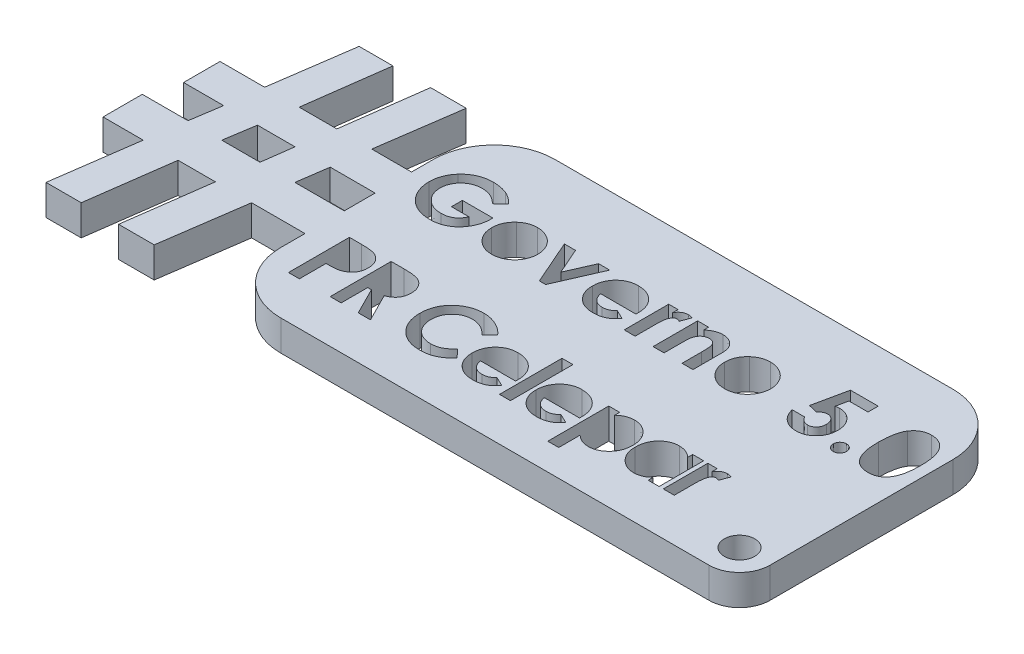
from build123d import *

# Parameters (mm, degrees)
SKETCH1_W           = 120
SKETCH1_H           = 45
BOSS_EXTRUDE1_DEPTH = 5
CUT_EXTRUDE2_DEPTH  = 5
CUT_EXTRUDE3_DEPTH  = 5
SKETCH4_R           = 2.605086118
SKETCH4_R_2         = 2.686047893
SKETCH4_W           = 4.185699939
SKETCH4_H           = 2.056815928
SKETCH4_W_2         = 4.02024203
SKETCH4_H_2         = 7.220001254
CUT_EXTRUDE4_DEPTH  = 5
SKETCH5_W           = 1.794871795
SKETCH5_H           = 10.256410257
CUT_EXTRUDE5_DEPTH  = 5
SKETCH6_R           = 2.760686407
SKETCH6_R_2         = 2.592680358
SKETCH6_W           = 2.943715355
SKETCH6_H           = 2.948054069
SKETCH6_W_2         = 3.461096163
SKETCH6_H_2         = 3.292240794
SKETCH6_W_3         = 4.465766707
SKETCH6_H_3         = 2.344287828
SKETCH6_W_4         = 4.473651302
SKETCH6_H_4         = 2.086202162
CUT_EXTRUDE6_DEPTH  = 5
FILLET1_R           = 10
FILLET2_R           = 10
SKETCH7_R           = 2.5
CUT_EXTRUDE7_DEPTH  = 5
FILLET3_R           = 5


with BuildPart() as part:
    # Sketch1 → Boss-Extrude1 (new body)
    with BuildSketch(Plane(origin=(0, 0, 0), x_dir=(1, 0, 0), z_dir=(0, 1, 0))):
        with Locations((60, 22.5)):
            Rectangle(SKETCH1_W, SKETCH1_H)
    extrude(amount=BOSS_EXTRUDE1_DEPTH)

    # Sketch2 → Cut-Extrude2 (cut)
    with BuildSketch(Plane(origin=(0, 5, 0), x_dir=(1, 0, 0), z_dir=(0, 1, 0))):
        Polygon((6.243956884, 0), (8.218553315, 13.97221886), (1.628438674, 13.97221886), (1.628438674, 20.410474037), (9.128427103, 20.410474037), (9.903197758, 25.473905073), (3.336957288, 25.473905073), (3.336957288, 31.446997178), (10.655578959, 31.446997178), (12.603493642, 45), (0, 45), (0, 0), align=None)
        Polygon((12.021141264, 0), (18.145763118, 0), (20.058630688, 13.97221886), (13.934008834, 13.97221886), align=None)
        Polygon((18.145763118, 45), (16.324497841, 31.446997178), (22.502423345, 31.446997178), (24.323688622, 45), align=None)
        Polygon((34.751310558, 31.446997178), (34.751310558, 45), (30.174716662, 45), (28.226801979, 31.446997178), align=None)
        Polygon((34.751310558, 20.410474037), (34.751310558, 25.473905073), (27.388963855, 25.473905073), (26.661218736, 20.410474037), align=None)
        Polygon((21.613732587, 25.473905073), (15.454062891, 25.473905073), (14.666198162, 20.410474037), (20.933303958, 20.410474037), align=None)
        Polygon((34.751310558, 13.97221886), (25.996087452, 13.97221886), (23.987920655, 0), (34.751310558, 0), align=None)
    extrude(amount=-CUT_EXTRUDE2_DEPTH, mode=Mode.SUBTRACT)

    # Sketch3 → Cut-Extrude3 (cut)
    # profile 1 of 10: a face of its own
    with BuildSketch(Plane(origin=(0, 5, 0), x_dir=(1, 0, 0), z_dir=(0, 1, 0))):
        with BuildLine():
            Line((47.242233209, 34.872979118), (45.884060132, 33.57289899))
            add(Edge.make_bspline(
                [(45.884060132, 33.57289899), (45.776531199, 33.680556761), (45.565541682, 33.891799082), (45.220494719, 34.166745479), (44.863130784, 34.400504271), (44.49227365, 34.592717101), (44.107406709, 34.741814084), (43.709289469, 34.848467926), (43.297274245, 34.911726127), (43.018358329, 34.92058206), (42.877249234, 34.925062452)],
                knots=[0, 0, 0, 0, 1.075575784, 2.110457258, 3.113929901, 4.09197124, 5.059417775, 6.02750972, 7.002078037, 8, 8, 8, 8], degree=3))
            add(Edge.make_bspline(
                [(42.877249234, 34.925062452), (42.754911963, 34.921923061), (42.514692008, 34.915758593), (42.161711918, 34.868946043), (41.824417821, 34.790747783), (41.501216199, 34.68241715), (41.19408031, 34.541444758), (40.901230552, 34.370006351), (40.624469125, 34.16679041), (40.365975325, 33.935649203), (40.130615888, 33.683289673), (39.925134672, 33.413175739), (39.75010882, 33.130342098), (39.606026848, 32.833341729), (39.496396136, 32.52263047), (39.418134153, 32.198433881), (39.368457256, 31.861694123), (39.362591898, 31.631966772), (39.359621029, 31.515607323)],
                knots=[0, 0, 0, 0, 1.075001177, 2.110859044, 3.123021556, 4.114053297, 5.101481495, 6.087880186, 7.091499647, 8.114004866, 9.131394192, 10.11971144, 11.092043119, 12.050101265, 13.015322563, 13.981809771, 14.977764287, 16, 16, 16, 16], degree=3))
            add(Edge.make_bspline(
                [(39.359621029, 31.515607323), (39.362392113, 31.395220518), (39.367851528, 31.158042031), (39.420295383, 30.809972406), (39.50109417, 30.475104344), (39.61936205, 30.155922489), (39.764913993, 29.848054496), (39.949497839, 29.55746406), (40.164741073, 29.279713548), (40.410259088, 29.019638754), (40.677319284, 28.779912384), (40.966554166, 28.573118247), (41.269163435, 28.394699545), (41.590031218, 28.2533977), (41.923588201, 28.139947798), (42.273217609, 28.059955881), (42.638132161, 28.010881118), (42.88711007, 28.004980243), (43.013467183, 28.001985529)],
                knots=[0, 0, 0, 0, 1.022067601, 2.013613092, 2.983553406, 3.943623673, 4.90013463, 5.87121881, 6.861774014, 7.881098904, 8.905697761, 9.905387765, 10.89678721, 11.884561068, 12.87834324, 13.885584958, 14.926927371, 16, 16, 16, 16], degree=3))
            add(Edge.make_bspline(
                [(43.013467183, 28.001985529), (43.095657806, 28.00272712), (43.257016285, 28.00418303), (43.493701678, 28.027816538), (43.720389434, 28.061603385), (43.937957454, 28.106333159), (44.144208884, 28.169633815), (44.341999416, 28.243656137), (44.530170171, 28.331017237), (44.707700909, 28.434731235), (44.877233801, 28.550981949), (45.037181986, 28.683997486), (45.190351143, 28.830778837), (45.334951511, 28.993119142), (45.468535687, 29.172469916), (45.595383368, 29.365535349), (45.71404217, 29.574231499), (45.784154526, 29.721602149), (45.819957568, 29.796857323)],
                knots=[0, 0, 0, 0, 1.109579412, 2.178351274, 3.208885622, 4.204702371, 5.174744997, 6.119429583, 7.05542196, 7.97267548, 8.893247984, 9.828544973, 10.778894627, 11.756245826, 12.760884819, 13.796418446, 14.874735809, 16, 16, 16, 16], degree=3))
            Line((45.819957568, 29.796857323), (42.949364619, 29.796857323))
            Line((42.949364619, 29.796857323), (42.949364619, 31.591729118))
            Line((42.949364619, 31.591729118), (47.935342183, 31.591729118))
            Line((47.935342183, 31.591729118), (47.949364619, 31.165046426))
            add(Edge.make_bspline(
                [(47.949364619, 31.165046426), (47.94756284, 31.055463484), (47.943962499, 30.836493162), (47.91105915, 30.510483654), (47.856555254, 30.188797987), (47.782043211, 29.871759252), (47.688660772, 29.557812262), (47.569568931, 29.249963321), (47.430113112, 28.946124698), (47.273862761, 28.647587473), (47.098282324, 28.361132889), (46.909244202, 28.089898213), (46.709443263, 27.834352892), (46.494533918, 27.598057313), (46.267862661, 27.37902649), (46.028983286, 27.17810306), (45.777050888, 26.995117017), (45.513400055, 26.828522547), (45.236529041, 26.682512323), (44.947960083, 26.555502799), (44.648128879, 26.447636292), (44.336261337, 26.359209221), (44.012971133, 26.290980701), (43.678251342, 26.244196315), (43.331918133, 26.212405799), (43.097007643, 26.208899082), (42.977409491, 26.207113734)],
                knots=[0, 0, 0, 0, 1.006889344, 2.011981806, 3.007738725, 4.003571281, 5.003404394, 6.015442001, 7.03424805, 8.074616296, 9.110249922, 10.119753985, 11.111721717, 12.089233633, 13.052717867, 14.006597561, 14.955430184, 15.912305663, 16.870361111, 17.829300583, 18.807640451, 19.796414044, 20.806216501, 21.841577364, 22.90109906, 24, 24, 24, 24], degree=3))
            add(Edge.make_bspline(
                [(42.977409491, 26.207113734), (42.849806371, 26.208876798), (42.596858929, 26.212371717), (42.222842235, 26.245104014), (41.859675998, 26.299126556), (41.507269636, 26.373891909), (41.164804932, 26.466943363), (40.832870294, 26.583744949), (40.512144617, 26.722684129), (40.201667479, 26.880081741), (39.905407115, 27.058584342), (39.624027493, 27.25506187), (39.359064435, 27.470778173), (39.1078039, 27.702122115), (38.876116304, 27.954780152), (38.655367556, 28.220562411), (38.456252178, 28.509216724), (38.270208797, 28.811384836), (38.104926372, 29.12694012), (37.960384515, 29.450046219), (37.837119302, 29.778832348), (37.739921701, 30.114829445), (37.661006353, 30.455694656), (37.60454094, 30.802910326), (37.572652283, 31.156432991), (37.567395279, 31.394018534), (37.564749234, 31.513604118)],
                knots=[0, 0, 0, 0, 1.084149091, 2.14910686, 3.187506334, 4.202448172, 5.208724393, 6.201130722, 7.189831603, 8.176984443, 9.156919086, 10.126598231, 11.090766514, 12.05840148, 13.026036446, 14.001772938, 14.991905635, 16.003017641, 17.015720547, 18.016462227, 19.009322657, 19.99686681, 20.986544154, 21.980959929, 22.983742515, 24, 24, 24, 24], degree=3))
            add(Edge.make_bspline(
                [(37.564749234, 31.513604118), (37.568292853, 31.67674441), (37.575290449, 31.998898119), (37.640098806, 32.473432576), (37.74112538, 32.932497314), (37.886108686, 33.374420451), (38.072156503, 33.799810741), (38.296633296, 34.209666808), (38.56441519, 34.603553011), (38.771696767, 34.847423275), (38.876848593, 34.97113617)],
                knots=[0, 0, 0, 0, 1.034044851, 2.041932006, 3.031217818, 4.011390712, 4.986069675, 5.97149666, 6.970960976, 8, 8, 8, 8], degree=3))
            add(Edge.make_bspline(
                [(38.876848593, 34.97113617), (38.942136335, 35.042707829), (39.071731521, 35.184776496), (39.278889189, 35.382183798), (39.491300434, 35.567753967), (39.711907186, 35.737552101), (39.939549754, 35.895295164), (40.174883335, 36.038026136), (40.416673423, 36.170289647), (40.666805688, 36.285331822), (40.923970653, 36.388476727), (41.189307261, 36.47575182), (41.460828196, 36.553056809), (41.740937784, 36.611866078), (42.026806251, 36.660837949), (42.320462785, 36.693661462), (42.621107157, 36.71771876), (42.824447889, 36.71918991), (42.927329363, 36.719934247)],
                knots=[0, 0, 0, 0, 1.020590567, 2.025856924, 3.013483481, 3.991664875, 4.957826714, 5.930500614, 6.890802512, 7.860442893, 8.829981142, 9.809047939, 10.802672283, 11.803273349, 12.823572789, 13.857849586, 14.916166035, 16, 16, 16, 16], degree=3))
            add(Edge.make_bspline(
                [(42.927329363, 36.719934247), (43.034873905, 36.718275725), (43.248848055, 36.714975875), (43.566992181, 36.692143071), (43.880715481, 36.656917435), (44.188695894, 36.60407697), (44.491967005, 36.538913679), (44.788959009, 36.455423374), (45.081609411, 36.36056335), (45.272123715, 36.28493393), (45.367233209, 36.247177836)],
                knots=[0, 0, 0, 0, 1.03180557, 2.052914215, 3.058998889, 4.059601663, 5.049854447, 6.033765722, 7.018406786, 8, 8, 8, 8], degree=3))
            add(Edge.make_bspline(
                [(45.367233209, 36.247177836), (45.447256083, 36.21228441), (45.610020396, 36.141312145), (45.846822409, 36.011465059), (46.084202996, 35.867514662), (46.319600697, 35.704197792), (46.552656833, 35.521819928), (46.785804757, 35.323261697), (47.016664413, 35.106207797), (47.166069852, 34.951728837), (47.242233209, 34.872979118)],
                knots=[0, 0, 0, 0, 0.894392155, 1.819168899, 2.76525314, 3.739198753, 4.75366411, 5.797420238, 6.877176959, 8, 8, 8, 8], degree=3))
        make_face()
    # profile 2 of 10: a face of its own
    with BuildSketch(Plane(origin=(0, 5, 0), x_dir=(1, 0, 0), z_dir=(0, 1, 0))):
        with BuildLine():
            add(Edge.make_bspline(
                [(52.96939667, 33.899421426), (53.054254744, 33.897911319), (53.22231218, 33.894920621), (53.472612737, 33.870025799), (53.718537464, 33.829408871), (53.961499901, 33.776817038), (54.199243918, 33.703128014), (54.433016451, 33.614749424), (54.664907725, 33.513280468), (54.889162244, 33.392496918), (55.107400079, 33.261496143), (55.314302536, 33.116991539), (55.50815143, 32.960118141), (55.692545259, 32.794513183), (55.858890971, 32.612966764), (56.017818951, 32.424226553), (56.160742706, 32.221530646), (56.293069515, 32.009818274), (56.410879122, 31.790313728), (56.513175099, 31.56454396), (56.601958389, 31.335630396), (56.671473926, 31.100784713), (56.729026383, 30.863103663), (56.765346074, 30.619674643), (56.791166856, 30.372998279), (56.794062184, 30.206915452), (56.795518465, 30.123379759)],
                knots=[0, 0, 0, 0, 1.022364134, 2.024744242, 3.027414945, 4.024939316, 5.017584196, 6.023349371, 7.035562955, 8.064994934, 9.090267829, 10.101425541, 11.102933353, 12.093946398, 13.084502048, 14.067315274, 15.065326281, 16.070028806, 17.074376865, 18.064572984, 19.055292013, 20.030201733, 21.013838017, 21.999348303, 22.993720005, 24, 24, 24, 24], degree=3))
            add(Edge.make_bspline(
                [(56.795518465, 30.123379759), (56.793981602, 30.039191444), (56.79092597, 29.871805987), (56.766280238, 29.622809327), (56.725507841, 29.378235574), (56.672714159, 29.1366439), (56.5993009, 28.901125703), (56.513525343, 28.668209351), (56.408232473, 28.441069582), (56.291823446, 28.217228514), (56.158645831, 28.003273107), (56.015845793, 27.798546676), (55.857583482, 27.608420158), (55.692569413, 27.426997199), (55.512976596, 27.260412714), (55.321671667, 27.105961813), (55.120310796, 26.961756265), (54.907445986, 26.831179405), (54.685803679, 26.716446175), (54.459121831, 26.613004805), (54.226074934, 26.526882478), (53.987145289, 26.456652092), (53.742187995, 26.402274462), (53.491743854, 26.365335091), (53.236352229, 26.339644185), (53.064279409, 26.336769918), (52.977409491, 26.335318862)],
                knots=[0, 0, 0, 0, 1.012026251, 2.012137606, 3.004615893, 3.992048833, 4.982446996, 5.968083444, 6.973977695, 7.990229942, 8.999482246, 10.001782172, 10.988562221, 11.971415814, 12.948383116, 13.930088534, 14.925840678, 15.924049238, 16.929462851, 17.924729459, 18.917889337, 19.913673841, 20.916777188, 21.931792057, 22.95587778, 24, 24, 24, 24], degree=3))
            add(Edge.make_bspline(
                [(52.977409491, 26.335318862), (52.850387956, 26.339047194), (52.600026578, 26.346395795), (52.231303459, 26.396731783), (51.877082259, 26.483373216), (51.53678578, 26.604149464), (51.209971966, 26.758919725), (50.89949299, 26.950471425), (50.602260429, 27.175033461), (50.323422578, 27.430707815), (50.067969332, 27.711205734), (49.844800187, 28.010635553), (49.655311523, 28.324509322), (49.499673822, 28.653184964), (49.379553255, 28.997113182), (49.29280571, 29.35526575), (49.24240818, 29.728649384), (49.235121732, 29.982336995), (49.231415901, 30.111360529)],
                knots=[0, 0, 0, 0, 1.029999031, 2.030143771, 3.011211297, 3.982305373, 4.953580601, 5.938004764, 6.935448627, 7.970290061, 9.001484052, 10.007591832, 10.993831261, 11.969999897, 12.951306496, 13.942897864, 14.953773953, 16, 16, 16, 16], degree=3))
            add(Edge.make_bspline(
                [(49.231415901, 30.111360529), (49.235250965, 30.249129379), (49.242788707, 30.519911296), (49.302641692, 30.916612976), (49.398220453, 31.296436034), (49.535417744, 31.658317984), (49.710675216, 32.002926269), (49.924624871, 32.329534073), (50.17832406, 32.638215374), (50.372606838, 32.824916408), (50.471399875, 32.919854118)],
                knots=[0, 0, 0, 0, 1.043912699, 2.05178951, 3.033892, 4.007821512, 4.978932272, 5.95884105, 6.962068106, 8, 8, 8, 8], degree=3))
            add(Edge.make_bspline(
                [(50.471399875, 32.919854118), (50.562052362, 32.998546802), (50.740890952, 33.153791175), (51.031444801, 33.350693212), (51.328939155, 33.5207565), (51.636939613, 33.660580153), (51.956304801, 33.766004932), (52.285398153, 33.842744738), (52.624151239, 33.889880576), (52.853730028, 33.896224981), (52.96939667, 33.899421426)],
                knots=[0, 0, 0, 0, 1.048115528, 2.067714963, 3.060638214, 4.039924844, 5.017819947, 5.994373833, 6.98952318, 8, 8, 8, 8], degree=3))
        make_face()
        with BuildLine():
            add(Edge.make_bspline(
                [(53.009460773, 32.232754759), (52.939968262, 32.230445058), (52.803171508, 32.225898387), (52.601803091, 32.201497618), (52.411346721, 32.151486147), (52.228019581, 32.087885242), (52.055064745, 32.002827993), (51.887745596, 31.90329141), (51.734762362, 31.778733625), (51.588711696, 31.642102848), (51.456130245, 31.490378036), (51.34315826, 31.325073967), (51.242215288, 31.152514828), (51.165675351, 30.966383014), (51.102331237, 30.771766048), (51.059460699, 30.565519512), (51.029625799, 30.349947291), (51.02741098, 30.202278842), (51.026287696, 30.12738617)],
                knots=[0, 0, 0, 0, 1.030650113, 2.02884584, 2.99876339, 3.944280128, 4.900564847, 5.851248946, 6.823638398, 7.81794922, 8.81432732, 9.802856497, 10.78262424, 11.771747962, 12.779760563, 13.812642396, 14.89064281, 16, 16, 16, 16], degree=3))
            add(Edge.make_bspline(
                [(51.026287696, 30.12738617), (51.027602092, 30.049852405), (51.030170825, 29.898327552), (51.056770603, 29.677080889), (51.100634512, 29.467119273), (51.16295138, 29.268767049), (51.241325365, 29.080600468), (51.337481155, 28.903675273), (51.452433567, 28.739055246), (51.582761703, 28.586943105), (51.725465444, 28.448869231), (51.881829049, 28.330379399), (52.045304596, 28.227427461), (52.21965945, 28.144741165), (52.402417273, 28.080900636), (52.594120596, 28.033897001), (52.795776822, 28.008573722), (52.933274499, 28.00421179), (53.003451157, 28.001985529)],
                knots=[0, 0, 0, 0, 1.141730614, 2.231293227, 3.276944405, 4.297399982, 5.28939179, 6.275415646, 7.257752684, 8.24146775, 9.222424823, 10.176631434, 11.126518621, 12.063689483, 13.012557477, 13.974037417, 14.965980454, 16, 16, 16, 16], degree=3))
            add(Edge.make_bspline(
                [(53.003451157, 28.001985529), (53.073662915, 28.003960122), (53.211318719, 28.007831472), (53.413211752, 28.036821765), (53.605894054, 28.082446773), (53.790212772, 28.146836756), (53.964677671, 28.231292908), (54.129956619, 28.334737382), (54.287503596, 28.454875301), (54.432122436, 28.595554366), (54.56599333, 28.748140891), (54.683390098, 28.913629935), (54.781491264, 29.090555176), (54.861951787, 29.277803397), (54.924390817, 29.475117227), (54.967528551, 29.683230058), (54.997379402, 29.901496932), (54.999544131, 30.051159845), (55.00064667, 30.12738617)],
                knots=[0, 0, 0, 0, 1.031504075, 2.022346795, 2.991027682, 3.937587355, 4.885570121, 5.833146507, 6.798790848, 7.791235734, 8.792807298, 9.778388351, 10.766749885, 11.760164525, 12.768777521, 13.802286646, 14.880660483, 16, 16, 16, 16], degree=3))
            add(Edge.make_bspline(
                [(55.00064667, 30.12738617), (54.999315554, 30.203585853), (54.996703472, 30.353114351), (54.970101799, 30.571676428), (54.926668358, 30.77911658), (54.863547739, 30.974549055), (54.785639599, 31.160203427), (54.689417346, 31.335129403), (54.573898025, 31.498465426), (54.442936328, 31.649401585), (54.298093368, 31.785537969), (54.144444613, 31.906938575), (53.978476589, 32.007346203), (53.803302955, 32.090117931), (53.618457659, 32.153798961), (53.424148219, 32.201068977), (53.219779137, 32.226031917), (53.080299588, 32.230490391), (53.009460773, 32.232754759)],
                knots=[0, 0, 0, 0, 1.123894411, 2.205445421, 3.243160173, 4.246488011, 5.231014757, 6.210004299, 7.185865357, 8.177612767, 9.153374344, 10.115157457, 11.061423229, 12.009021698, 12.96873347, 13.94135618, 14.954456845, 16, 16, 16, 16], degree=3))
        make_face(mode=Mode.SUBTRACT)
    # profile 3 of 10: a face of its own
    with BuildSketch(Plane(origin=(0, 5, 0), x_dir=(1, 0, 0), z_dir=(0, 1, 0))):
        Polygon((57.50064667, 33.771216298), (59.327569747, 33.771216298), (61.218595388, 29.458315657), (63.109621029, 33.771216298), (64.936544106, 33.771216298), (61.735422311, 26.46352399), (60.701768465, 26.46352399), align=None)
    # profile 4 of 10: a face of its own
    with BuildSketch(Plane(origin=(0, 5, 0), x_dir=(1, 0, 0), z_dir=(0, 1, 0))):
        with BuildLine():
            Line((73.327970388, 29.668652195), (67.564749234, 29.668652195))
            add(Edge.make_bspline(
                [(67.564749234, 29.668652195), (67.576499977, 29.601686835), (67.599591113, 29.470094619), (67.649734336, 29.278945506), (67.713724609, 29.098809809), (67.790412922, 28.92944673), (67.87850631, 28.769960913), (67.981259948, 28.621100408), (68.097370501, 28.482996699), (68.226166648, 28.35625), (68.365501591, 28.24268221), (68.514699608, 28.143189648), (68.67391466, 28.061611832), (68.841321408, 27.992850199), (69.018170766, 27.93838402), (69.20472301, 27.900819731), (69.40048362, 27.878630369), (69.533841728, 27.875420931), (69.60200885, 27.8737804)],
                knots=[0, 0, 0, 0, 1.091296461, 2.144483647, 3.168565212, 4.157007626, 5.126487748, 6.090021542, 7.05641414, 8.019231907, 8.98705074, 9.938580405, 10.892824166, 11.854447369, 12.841318655, 13.858982407, 14.905600794, 16, 16, 16, 16], degree=3))
            add(Edge.make_bspline(
                [(69.60200885, 27.8737804), (69.684291193, 27.875952734), (69.84632936, 27.880230698), (70.08371648, 27.918169886), (70.313304404, 27.975475362), (70.532920423, 28.060693414), (70.745108442, 28.166774909), (70.946375196, 28.298939399), (71.140204453, 28.453324606), (71.258463142, 28.572324665), (71.318755645, 28.632995144)],
                knots=[0, 0, 0, 0, 1.021034703, 2.010718019, 2.977989445, 3.954245119, 4.929443971, 5.918328161, 6.938689359, 8, 8, 8, 8], degree=3))
            Line((71.318755645, 28.632995144), (72.821159491, 27.917850913))
            add(Edge.make_bspline(
                [(72.821159491, 27.917850913), (72.773857183, 27.852486383), (72.680129398, 27.72296897), (72.527121936, 27.54070452), (72.367448906, 27.370644394), (72.200991225, 27.213907103), (72.027537782, 27.070939287), (71.847571083, 26.93999934), (71.658460989, 26.824602946), (71.463988722, 26.719167297), (71.260134179, 26.628777804), (71.047461517, 26.551696836), (70.826871524, 26.482016296), (70.595578624, 26.428923542), (70.355508792, 26.386895751), (70.106087733, 26.357050451), (69.84734832, 26.33861644), (69.671484648, 26.336431111), (69.581976798, 26.335318862)],
                knots=[0, 0, 0, 0, 1.028154879, 2.037251081, 3.030720504, 4.000128189, 4.949298328, 5.894184978, 6.834267904, 7.770992897, 8.712077017, 9.673380525, 10.653304757, 11.658697181, 12.695551717, 13.758623199, 14.859225354, 16, 16, 16, 16], degree=3))
            add(Edge.make_bspline(
                [(69.581976798, 26.335318862), (69.444270442, 26.33812628), (69.174580478, 26.343624447), (68.780110155, 26.394655306), (68.405472758, 26.479269969), (68.049610441, 26.594290609), (67.714061481, 26.746153887), (67.398659812, 26.931895273), (67.100254119, 27.147953734), (66.827962365, 27.398863761), (66.579896543, 27.671964409), (66.362010949, 27.965255856), (66.179687386, 28.276688984), (66.02995961, 28.604202666), (65.91358598, 28.948635207), (65.829687344, 29.310136911), (65.778256474, 29.688535117), (65.772701685, 29.946266536), (65.76987744, 30.077306041)],
                knots=[0, 0, 0, 0, 1.103565453, 2.161269334, 3.182010356, 4.179077853, 5.15417608, 6.128274628, 7.109042802, 8.101804412, 9.090965879, 10.063106201, 11.02526161, 11.978650795, 12.945248442, 13.93468508, 14.949922959, 16, 16, 16, 16], degree=3))
            add(Edge.make_bspline(
                [(65.76987744, 30.077306041), (65.772729482, 30.211675429), (65.778340747, 30.476041164), (65.829244524, 30.863176758), (65.913817931, 31.232556477), (66.030531979, 31.584688997), (66.177988367, 31.920675635), (66.362631684, 32.237576913), (66.579788418, 32.536496107), (66.826960588, 32.816034844), (67.100405854, 33.068349094), (67.390967285, 33.293211514), (67.701909634, 33.480581808), (68.029715876, 33.631976889), (68.372289245, 33.754981571), (68.73358941, 33.836830914), (69.110867427, 33.891787848), (69.368766371, 33.896849039), (69.499845388, 33.899421426)],
                knots=[0, 0, 0, 0, 1.079208495, 2.12329425, 3.130605359, 4.119693003, 5.099659317, 6.073216462, 7.060498243, 8.06384408, 9.066070512, 10.045757761, 11.010926815, 11.975797609, 12.942977511, 13.929384301, 14.947594487, 16, 16, 16, 16], degree=3))
            add(Edge.make_bspline(
                [(69.499845388, 33.899421426), (69.638211452, 33.896570453), (69.909878959, 33.89097286), (70.307096647, 33.840356361), (70.684221591, 33.755225727), (71.042860555, 33.64119965), (71.378433572, 33.485500146), (71.698314199, 33.30432956), (71.994829884, 33.083600832), (72.271141169, 32.833918678), (72.520568575, 32.556904981), (72.738595764, 32.255983262), (72.924110068, 31.934090342), (73.074471252, 31.589920875), (73.190725387, 31.224508093), (73.274701687, 30.838326555), (73.325740262, 30.429907412), (73.331191689, 30.150239417), (73.333980004, 30.007193862)],
                knots=[0, 0, 0, 0, 1.080001299, 2.120471247, 3.119684163, 4.095710327, 5.052285597, 6.002875087, 6.961153713, 7.931888285, 8.906493152, 9.865905668, 10.82813294, 11.801621613, 12.7925306, 13.817193356, 14.883530496, 16, 16, 16, 16], degree=3))
            Line((73.333980004, 30.007193862), (73.327970388, 29.668652195))
        make_face()
        with BuildLine():
            add(Edge.make_bspline(
                [(71.539108209, 31.078908606), (71.50523788, 31.170310902), (71.437894844, 31.352042478), (71.285769727, 31.60278771), (71.083904565, 31.819943264), (70.8491209, 32.012192798), (70.580865861, 32.168234529), (70.287592634, 32.28121381), (69.973008137, 32.348957604), (69.756590956, 32.356902761), (69.646079363, 32.360959888)],
                knots=[0, 0, 0, 0, 0.954238005, 1.897273737, 2.851915805, 3.847685534, 4.862635127, 5.880135777, 6.917509367, 8, 8, 8, 8], degree=3))
            add(Edge.make_bspline(
                [(69.646079363, 32.360959888), (69.52538271, 32.357062523), (69.289445886, 32.349443988), (68.949123081, 32.268418065), (68.628105095, 32.147489295), (68.438851085, 32.022809166), (68.343996029, 31.960318862)],
                knots=[0, 0, 0, 0, 1.044195649, 2.041185066, 3.018232172, 4, 4, 4, 4], degree=3))
            add(Edge.make_bspline(
                [(68.343996029, 31.960318862), (68.284813559, 31.912724878), (68.158639558, 31.811256937), (67.99477702, 31.608838028), (67.833371056, 31.36375417), (67.741602867, 31.177595665), (67.692954363, 31.078908606)],
                knots=[0, 0, 0, 0, 0.82159062, 1.751589201, 2.808063854, 4, 4, 4, 4], degree=3))
            Line((67.692954363, 31.078908606), (71.539108209, 31.078908606))
        make_face(mode=Mode.SUBTRACT)
    # profile 5 of 10: a face of its own
    with BuildSketch(Plane(origin=(0, 5, 0), x_dir=(1, 0, 0), z_dir=(0, 1, 0))):
        with BuildLine():
            Line((74.616031286, 33.771216298), (76.154492824, 33.771216298))
            Line((76.154492824, 33.771216298), (76.154492824, 32.871777195))
            add(Edge.make_bspline(
                [(76.154492824, 32.871777195), (76.198012948, 32.951710596), (76.283074834, 33.107943743), (76.439340655, 33.317655804), (76.618865158, 33.494269451), (76.815197474, 33.641478719), (77.028932647, 33.756213889), (77.254347231, 33.837977161), (77.489512807, 33.891111959), (77.649934791, 33.896631659), (77.73101526, 33.899421426)],
                knots=[0, 0, 0, 0, 1.09866127, 2.147379032, 3.14564304, 4.131443017, 5.102343063, 6.064490016, 7.021754664, 8, 8, 8, 8], degree=3))
            add(Edge.make_bspline(
                [(77.73101526, 33.899421426), (77.789889798, 33.896664554), (77.909779379, 33.891050577), (78.092507973, 33.858416445), (78.277873019, 33.79940773), (78.399859192, 33.746278224), (78.462185132, 33.719132964)],
                knots=[0, 0, 0, 0, 0.931404136, 1.896671404, 2.925354185, 4, 4, 4, 4], degree=3))
            Line((78.462185132, 33.719132964), (77.905294106, 32.198700272))
            add(Edge.make_bspline(
                [(77.905294106, 32.198700272), (77.855516001, 32.222750646), (77.761952325, 32.26795609), (77.626114114, 32.321303172), (77.502835305, 32.353852953), (77.424678803, 32.358709666), (77.388467183, 32.360959888)],
                knots=[0, 0, 0, 0, 1.214386998, 2.282580073, 3.20428172, 4, 4, 4, 4], degree=3))
            add(Edge.make_bspline(
                [(77.388467183, 32.360959888), (77.354276372, 32.359468772), (77.287017156, 32.356535491), (77.187744434, 32.331398267), (77.094250203, 32.288049902), (77.00202898, 32.232516346), (76.918355997, 32.155320549), (76.834734698, 32.065952707), (76.761043131, 31.95561622), (76.683277156, 31.832806107), (76.61706221, 31.682486638), (76.560284932, 31.50303617), (76.509695922, 31.292378336), (76.474883776, 31.049394648), (76.441236439, 30.776436391), (76.421208718, 30.471500086), (76.406281804, 30.135549972), (76.405369123, 29.901044667), (76.404893465, 29.778828477)],
                knots=[0, 0, 0, 0, 0.544232178, 1.070598461, 1.618251235, 2.182094276, 2.777567932, 3.425210017, 4.127676488, 4.886675562, 5.738955394, 6.734782583, 7.883056018, 9.186093582, 10.642914445, 12.264202625, 14.053029461, 16, 16, 16, 16], degree=3))
            Line((76.404893465, 29.778828477), (76.410903081, 29.422257964))
            Line((76.410903081, 29.422257964), (76.410903081, 26.46352399))
            Line((76.410903081, 26.46352399), (74.616031286, 26.46352399))
            Line((74.616031286, 26.46352399), (74.616031286, 33.771216298))
        make_face()
    # profile 6 of 10: a face of its own
    with BuildSketch(Plane(origin=(0, 5, 0), x_dir=(1, 0, 0), z_dir=(0, 1, 0))):
        with BuildLine():
            Line((79.359621029, 33.771216298), (81.154492824, 33.771216298))
            Line((81.154492824, 33.771216298), (81.154492824, 32.997979118))
            add(Edge.make_bspline(
                [(81.154492824, 32.997979118), (81.25688937, 33.077625261), (81.452589076, 33.229844522), (81.750086416, 33.423924856), (82.030887073, 33.582771816), (82.301250392, 33.703598942), (82.566263268, 33.790528864), (82.830217774, 33.852982827), (83.097044728, 33.892973816), (83.276417208, 33.897273376), (83.366031286, 33.899421426)],
                knots=[0, 0, 0, 0, 1.276643801, 2.439914479, 3.493451431, 4.44993799, 5.350072675, 6.235028322, 7.118224225, 8, 8, 8, 8], degree=3))
            add(Edge.make_bspline(
                [(83.366031286, 33.899421426), (83.456932708, 33.896966649), (83.635379834, 33.892147717), (83.898133393, 33.858443187), (84.149168902, 33.797056561), (84.391309048, 33.715551725), (84.622089258, 33.607970015), (84.844336731, 33.48023419), (85.053277668, 33.324643313), (85.181952748, 33.206152771), (85.247040901, 33.146216298)],
                knots=[0, 0, 0, 0, 1.048836932, 2.058954983, 3.049370783, 4.026390553, 5.001981509, 5.982488534, 6.97947532, 8, 8, 8, 8], degree=3))
            add(Edge.make_bspline(
                [(85.247040901, 33.146216298), (85.299243996, 33.090672713), (85.404032249, 32.979179032), (85.5358951, 32.788384787), (85.649048259, 32.580384138), (85.741761549, 32.352777729), (85.810272936, 32.104315011), (85.86297968, 31.837997059), (85.892554354, 31.552332688), (85.896205486, 31.356083961), (85.898082568, 31.255190657)],
                knots=[0, 0, 0, 0, 0.889584746, 1.785680191, 2.700364693, 3.65222533, 4.649950538, 5.707241244, 6.821271309, 8, 8, 8, 8], degree=3))
            Line((85.898082568, 31.255190657), (85.898082568, 26.46352399))
            Line((85.898082568, 26.46352399), (84.103210773, 26.46352399))
            Line((84.103210773, 26.46352399), (84.103210773, 29.636600913))
            add(Edge.make_bspline(
                [(84.103210773, 29.636600913), (84.102831197, 29.740101155), (84.102103811, 29.938440157), (84.096519092, 30.222293077), (84.085614468, 30.478649125), (84.075675187, 30.707975053), (84.056160427, 30.909456599), (84.038561702, 31.084369295), (84.011558164, 31.231126319), (83.97642218, 31.388985519), (83.915066098, 31.55800266), (83.819813773, 31.736090141), (83.698972841, 31.887379426), (83.557478929, 32.012931128), (83.395488304, 32.112254041), (83.214958389, 32.182133897), (83.016857039, 32.225684739), (82.878822346, 32.230338125), (82.807137055, 32.232754759)],
                knots=[0, 0, 0, 0, 1.49886392, 2.872294502, 4.110984203, 5.214877267, 6.195405875, 7.042225351, 7.75923308, 8.355011229, 9.382752534, 10.352059385, 11.267231453, 12.171456522, 13.078624015, 14.003401117, 14.963110155, 16, 16, 16, 16], degree=3))
            add(Edge.make_bspline(
                [(82.807137055, 32.232754759), (82.713907319, 32.228027055), (82.531531832, 32.218778745), (82.267762174, 32.149038052), (82.025494139, 32.030429662), (81.806707254, 31.8662995), (81.613485283, 31.663660478), (81.454342541, 31.421990198), (81.323812799, 31.147121359), (81.26768307, 30.946422459), (81.23862744, 30.8425304)],
                knots=[0, 0, 0, 0, 0.984188326, 1.925263693, 2.85911992, 3.81709677, 4.80007086, 5.801799564, 6.862098548, 8, 8, 8, 8], degree=3))
            add(Edge.make_bspline(
                [(81.23862744, 30.8425304), (81.231405961, 30.809902403), (81.215300612, 30.737135409), (81.202056, 30.614203527), (81.183631783, 30.468356751), (81.176728681, 30.296955664), (81.164724948, 30.100811438), (81.160285394, 29.879664578), (81.155837896, 29.633948715), (81.154956035, 29.462325522), (81.154492824, 29.372177836)],
                knots=[0, 0, 0, 0, 0.543362196, 1.211806945, 2.009705693, 2.934833164, 4.000995085, 5.207458376, 6.533175157, 8, 8, 8, 8], degree=3))
            Line((81.154492824, 29.372177836), (81.154492824, 26.46352399))
            Line((81.154492824, 26.46352399), (79.359621029, 26.46352399))
            Line((79.359621029, 26.46352399), (79.359621029, 33.771216298))
        make_face()
    # profile 7 of 10: a face of its own
    with BuildSketch(Plane(origin=(0, 5, 0), x_dir=(1, 0, 0), z_dir=(0, 1, 0))):
        with BuildLine():
            add(Edge.make_bspline(
                [(91.174524875, 33.899421426), (91.259382949, 33.897911319), (91.427440385, 33.894920621), (91.677740942, 33.870025799), (91.923665669, 33.829408871), (92.166628106, 33.776817038), (92.404372123, 33.703128014), (92.638144656, 33.614749424), (92.87003593, 33.513280468), (93.094290449, 33.392496918), (93.312528284, 33.261496143), (93.519430741, 33.116991539), (93.713279636, 32.960118141), (93.897673464, 32.794513183), (94.064019176, 32.612966764), (94.222947156, 32.424226553), (94.365870911, 32.221530646), (94.498197721, 32.009818274), (94.616007327, 31.790313728), (94.718303304, 31.56454396), (94.807086594, 31.335630396), (94.876602131, 31.100784713), (94.934154588, 30.863103663), (94.970474279, 30.619674643), (94.996295061, 30.372998279), (94.999190389, 30.206915452), (95.00064667, 30.123379759)],
                knots=[0, 0, 0, 0, 1.022364134, 2.024744242, 3.027414945, 4.024939316, 5.017584196, 6.023349371, 7.035562955, 8.064994934, 9.090267829, 10.101425541, 11.102933353, 12.093946398, 13.084502048, 14.067315274, 15.065326281, 16.070028806, 17.074376865, 18.064572984, 19.055292013, 20.030201733, 21.013838017, 21.999348303, 22.993720005, 24, 24, 24, 24], degree=3))
            add(Edge.make_bspline(
                [(95.00064667, 30.123379759), (94.999109807, 30.039191444), (94.996054175, 29.871805987), (94.971408443, 29.622809327), (94.930636046, 29.378235574), (94.877842364, 29.1366439), (94.804429105, 28.901125703), (94.718653548, 28.668209351), (94.613360678, 28.441069582), (94.496951652, 28.217228514), (94.363774037, 28.003273107), (94.220973998, 27.798546676), (94.062711687, 27.608420158), (93.897697618, 27.426997199), (93.718104801, 27.260412714), (93.526799872, 27.105961813), (93.325439001, 26.961756265), (93.112574191, 26.831179405), (92.890931884, 26.716446175), (92.664250037, 26.613004805), (92.431203139, 26.526882478), (92.192273495, 26.456652092), (91.947316201, 26.402274462), (91.696872059, 26.365335091), (91.441480435, 26.339644185), (91.269407614, 26.336769918), (91.182537696, 26.335318862)],
                knots=[0, 0, 0, 0, 1.012026251, 2.012137606, 3.004615893, 3.992048833, 4.982446996, 5.968083444, 6.973977695, 7.990229942, 8.999482246, 10.001782172, 10.988562221, 11.971415814, 12.948383116, 13.930088534, 14.925840678, 15.924049238, 16.929462851, 17.924729459, 18.917889337, 19.913673841, 20.916777188, 21.931792057, 22.95587778, 24, 24, 24, 24], degree=3))
            add(Edge.make_bspline(
                [(91.182537696, 26.335318862), (91.055516161, 26.339047194), (90.805154783, 26.346395795), (90.436431664, 26.396731783), (90.082210464, 26.483373216), (89.741913985, 26.604149464), (89.415100172, 26.758919725), (89.104621195, 26.950471425), (88.807388634, 27.175033461), (88.528550783, 27.430707815), (88.273097537, 27.711205734), (88.049928392, 28.010635553), (87.860439728, 28.324509322), (87.704802027, 28.653184964), (87.58468146, 28.997113182), (87.497933915, 29.35526575), (87.447536385, 29.728649384), (87.440249937, 29.982336995), (87.436544106, 30.111360529)],
                knots=[0, 0, 0, 0, 1.029999031, 2.030143771, 3.011211297, 3.982305373, 4.953580601, 5.938004764, 6.935448627, 7.970290061, 9.001484052, 10.007591832, 10.993831261, 11.969999897, 12.951306496, 13.942897864, 14.953773953, 16, 16, 16, 16], degree=3))
            add(Edge.make_bspline(
                [(87.436544106, 30.111360529), (87.44037917, 30.249129379), (87.447916912, 30.519911296), (87.507769897, 30.916612976), (87.603348658, 31.296436034), (87.740545949, 31.658317984), (87.915803421, 32.002926269), (88.129753076, 32.329534073), (88.383452266, 32.638215374), (88.577735044, 32.824916408), (88.676528081, 32.919854118)],
                knots=[0, 0, 0, 0, 1.043912699, 2.05178951, 3.033892, 4.007821512, 4.978932272, 5.95884105, 6.962068106, 8, 8, 8, 8], degree=3))
            add(Edge.make_bspline(
                [(88.676528081, 32.919854118), (88.767180567, 32.998546802), (88.946019157, 33.153791175), (89.236573006, 33.350693212), (89.53406736, 33.5207565), (89.842067818, 33.660580153), (90.161433006, 33.766004932), (90.490526359, 33.842744738), (90.829279445, 33.889880576), (91.058858233, 33.896224981), (91.174524875, 33.899421426)],
                knots=[0, 0, 0, 0, 1.048115528, 2.067714963, 3.060638214, 4.039924844, 5.017819947, 5.994373833, 6.98952318, 8, 8, 8, 8], degree=3))
        make_face()
        with BuildLine():
            add(Edge.make_bspline(
                [(91.214588978, 32.232754759), (91.145096468, 32.230445058), (91.008299713, 32.225898387), (90.806931296, 32.201497618), (90.616474926, 32.151486147), (90.433147786, 32.087885242), (90.26019295, 32.002827993), (90.092873801, 31.90329141), (89.939890567, 31.778733625), (89.793839901, 31.642102848), (89.66125845, 31.490378036), (89.548286465, 31.325073967), (89.447343493, 31.152514828), (89.370803556, 30.966383014), (89.307459442, 30.771766048), (89.264588905, 30.565519512), (89.234754004, 30.349947291), (89.232539186, 30.202278842), (89.231415901, 30.12738617)],
                knots=[0, 0, 0, 0, 1.030650113, 2.02884584, 2.99876339, 3.944280128, 4.900564847, 5.851248946, 6.823638398, 7.81794922, 8.81432732, 9.802856497, 10.78262424, 11.771747962, 12.779760563, 13.812642396, 14.89064281, 16, 16, 16, 16], degree=3))
            add(Edge.make_bspline(
                [(89.231415901, 30.12738617), (89.232730297, 30.049852405), (89.235299031, 29.898327552), (89.261898808, 29.677080889), (89.305762717, 29.467119273), (89.368079585, 29.268767049), (89.44645357, 29.080600468), (89.54260936, 28.903675273), (89.657561772, 28.739055246), (89.787889908, 28.586943105), (89.93059365, 28.448869231), (90.086957254, 28.330379399), (90.250432801, 28.227427461), (90.424787655, 28.144741165), (90.607545478, 28.080900636), (90.799248802, 28.033897001), (91.000905027, 28.008573722), (91.138402704, 28.00421179), (91.208579363, 28.001985529)],
                knots=[0, 0, 0, 0, 1.141730614, 2.231293227, 3.276944405, 4.297399982, 5.28939179, 6.275415646, 7.257752684, 8.24146775, 9.222424823, 10.176631434, 11.126518621, 12.063689483, 13.012557477, 13.974037417, 14.965980454, 16, 16, 16, 16], degree=3))
            add(Edge.make_bspline(
                [(91.208579363, 28.001985529), (91.27879112, 28.003960122), (91.416446925, 28.007831472), (91.618339958, 28.036821765), (91.811022259, 28.082446773), (91.995340977, 28.146836756), (92.169805876, 28.231292908), (92.335084824, 28.334737382), (92.492631801, 28.454875301), (92.637250641, 28.595554366), (92.771121535, 28.748140891), (92.888518303, 28.913629935), (92.986619469, 29.090555176), (93.067079992, 29.277803397), (93.129519022, 29.475117227), (93.172656756, 29.683230058), (93.202507608, 29.901496932), (93.204672336, 30.051159845), (93.205774875, 30.12738617)],
                knots=[0, 0, 0, 0, 1.031504075, 2.022346795, 2.991027682, 3.937587355, 4.885570121, 5.833146507, 6.798790848, 7.791235734, 8.792807298, 9.778388351, 10.766749885, 11.760164525, 12.768777521, 13.802286646, 14.880660483, 16, 16, 16, 16], degree=3))
            add(Edge.make_bspline(
                [(93.205774875, 30.12738617), (93.204443759, 30.203585853), (93.201831677, 30.353114351), (93.175230004, 30.571676428), (93.131796563, 30.77911658), (93.068675944, 30.974549055), (92.990767804, 31.160203427), (92.894545552, 31.335129403), (92.77902623, 31.498465426), (92.648064533, 31.649401585), (92.503221573, 31.785537969), (92.349572818, 31.906938575), (92.183604794, 32.007346203), (92.00843116, 32.090117931), (91.823585864, 32.153798961), (91.629276424, 32.201068977), (91.424907342, 32.226031917), (91.285427793, 32.230490391), (91.214588978, 32.232754759)],
                knots=[0, 0, 0, 0, 1.123894411, 2.205445421, 3.243160173, 4.246488011, 5.231014757, 6.210004299, 7.185865357, 8.177612767, 9.153374344, 10.115157457, 11.061423229, 12.009021698, 12.96873347, 13.94135618, 14.954456845, 16, 16, 16, 16], degree=3))
        make_face(mode=Mode.SUBTRACT)
    # profile 8 of 10: a face of its own
    with BuildSketch(Plane(origin=(0, 5, 0), x_dir=(1, 0, 0), z_dir=(0, 1, 0))):
        with BuildLine():
            Line((101.729412696, 36.46352399), (106.282697952, 36.46352399))
            Line((106.282697952, 36.46352399), (106.282697952, 34.796857323))
            Line((106.282697952, 34.796857323), (103.151688337, 34.796857323))
            Line((103.151688337, 34.796857323), (102.761063337, 32.905831682))
            add(Edge.make_bspline(
                [(102.761063337, 32.905831682), (102.814291585, 32.920656421), (102.919268626, 32.949893853), (103.077416669, 32.979215297), (103.230684162, 32.998220525), (103.331257355, 33.000755569), (103.380053722, 33.001985529)],
                knots=[0, 0, 0, 0, 1.05461699, 2.079921384, 3.068411212, 4, 4, 4, 4], degree=3))
            add(Edge.make_bspline(
                [(103.380053722, 33.001985529), (103.486386115, 32.999548983), (103.695990688, 32.994746016), (104.002615579, 32.94915019), (104.296227026, 32.877338146), (104.575926546, 32.774919354), (104.841440908, 32.641618652), (105.093091971, 32.480362169), (105.331188591, 32.290866681), (105.551501172, 32.073013547), (105.753933574, 31.833805873), (105.929937001, 31.575077463), (106.080254912, 31.300517532), (106.199812582, 31.008419422), (106.294177687, 30.700617705), (106.362368019, 30.376915132), (106.402692369, 30.036928067), (106.408129861, 29.804979201), (106.410903081, 29.686681041)],
                knots=[0, 0, 0, 0, 1.01440847, 1.999622559, 2.951875003, 3.895578053, 4.836219714, 5.782137149, 6.743708247, 7.735272588, 8.734977101, 9.730283169, 10.717124674, 11.717316708, 12.737475749, 13.78628267, 14.87096371, 16, 16, 16, 16], degree=3))
            add(Edge.make_bspline(
                [(106.410903081, 29.686681041), (106.407514161, 29.567039923), (106.400826833, 29.330953024), (106.357198142, 28.983821774), (106.280192719, 28.651348401), (106.174418065, 28.332642883), (106.03506673, 28.030047631), (105.867477678, 27.740427981), (105.668817429, 27.46593369), (105.441035523, 27.209378655), (105.19340671, 26.974882429), (104.92974048, 26.768595649), (104.651889166, 26.595006995), (104.359846065, 26.454718015), (104.055286721, 26.343723872), (103.738118695, 26.262925433), (103.406800594, 26.216592018), (103.181878651, 26.21030788), (103.067553722, 26.207113734)],
                knots=[0, 0, 0, 0, 1.06808661, 2.107647099, 3.116961351, 4.110378221, 5.100014249, 6.085620622, 7.093190682, 8.119403071, 9.144090782, 10.133780668, 11.103064255, 12.062861538, 13.020824475, 13.992378307, 14.979551724, 16, 16, 16, 16], degree=3))
            add(Edge.make_bspline(
                [(103.067553722, 26.207113734), (102.96531634, 26.209726744), (102.763682828, 26.214880148), (102.466685517, 26.246555684), (102.180347129, 26.302558328), (101.906187807, 26.383608654), (101.641322936, 26.483363102), (101.388814431, 26.608124892), (101.147274714, 26.755518391), (100.917389666, 26.922853663), (100.702894593, 27.111350357), (100.507126218, 27.317692466), (100.328899336, 27.539279148), (100.172027722, 27.778844109), (100.037003121, 28.036033405), (99.91726055, 28.307816003), (99.819250057, 28.597030178), (99.769512554, 28.797529513), (99.744236414, 28.899421426)],
                knots=[0, 0, 0, 0, 1.054957082, 2.080596141, 3.077793124, 4.061112343, 5.027190972, 5.994718051, 6.962465889, 7.943658696, 8.924948258, 9.904494768, 10.875059, 11.855380583, 12.854004648, 13.869083016, 14.917087635, 16, 16, 16, 16], degree=3))
            Line((99.744236414, 28.899421426), (101.795518465, 28.899421426))
            add(Edge.make_bspline(
                [(101.795518465, 28.899421426), (101.833015951, 28.828814479), (101.905888034, 28.691597936), (102.044506848, 28.509422357), (102.199681809, 28.354070849), (102.370013156, 28.224025596), (102.556604529, 28.126597905), (102.751852682, 28.052713252), (102.958210436, 28.010018047), (103.098749178, 28.004680723), (103.169717183, 28.001985529)],
                knots=[0, 0, 0, 0, 1.104910296, 2.147267069, 3.153527244, 4.136738762, 5.099945312, 6.05603338, 7.018353, 8, 8, 8, 8], degree=3))
            add(Edge.make_bspline(
                [(103.169717183, 28.001985529), (103.219180931, 28.003846584), (103.316501688, 28.007508241), (103.459888435, 28.026879329), (103.596757384, 28.063567729), (103.728126123, 28.114372635), (103.854347543, 28.177732091), (103.973612215, 28.257719275), (104.08799513, 28.34978749), (104.195754917, 28.455436079), (104.293354223, 28.573209681), (104.378938138, 28.699765445), (104.455461961, 28.832291274), (104.512144326, 28.97603685), (104.55856239, 29.126709878), (104.59274653, 29.285446932), (104.613175409, 29.452433403), (104.615066577, 29.566430385), (104.616031286, 29.624581682)],
                knots=[0, 0, 0, 0, 0.978869489, 1.925942215, 2.855067702, 3.774946051, 4.70828698, 5.642468714, 6.60995405, 7.609372294, 8.622401667, 9.629904756, 10.629323, 11.642352373, 12.678539694, 13.745912462, 14.850161547, 16, 16, 16, 16], degree=3))
            add(Edge.make_bspline(
                [(104.616031286, 29.624581682), (104.61491163, 29.681383156), (104.612732193, 29.791948603), (104.594703453, 29.954298284), (104.562450386, 30.10833875), (104.518505304, 30.255249835), (104.462250354, 30.394139425), (104.393503044, 30.525834258), (104.31196968, 30.649668663), (104.217212525, 30.763121495), (104.11616447, 30.867183659), (104.007606389, 30.958195599), (103.892516333, 31.033729189), (103.774470584, 31.099672212), (103.64875718, 31.147664106), (103.51820291, 31.180714353), (103.382945071, 31.204965295), (103.290688634, 31.206390126), (103.243835773, 31.207113734)],
                knots=[0, 0, 0, 0, 1.166249705, 2.270133367, 3.348514167, 4.393962215, 5.415026464, 6.420877785, 7.440098956, 8.453121383, 9.451844239, 10.415694839, 11.355045125, 12.27538808, 13.187007209, 14.108269027, 15.039275622, 16, 16, 16, 16], degree=3))
            add(Edge.make_bspline(
                [(103.243835773, 31.207113734), (103.192942677, 31.205182623), (103.090941994, 31.201312264), (102.939394507, 31.169820184), (102.789674263, 31.118854186), (102.640948662, 31.048538515), (102.494694062, 30.956517487), (102.347050734, 30.848587373), (102.202960617, 30.716906023), (102.111344112, 30.618829455), (102.063947952, 30.568091298)],
                knots=[0, 0, 0, 0, 0.88288272, 1.769486374, 2.674910571, 3.623812639, 4.617874466, 5.670434592, 6.794841017, 8, 8, 8, 8], degree=3))
            Line((102.063947952, 30.568091298), (100.553531286, 30.914645785))
            Line((100.553531286, 30.914645785), (101.729412696, 36.46352399))
        make_face()
    # profile 9 of 10: a face of its own
    with BuildSketch(Plane(origin=(0, 5, 0), x_dir=(1, 0, 0), z_dir=(0, 1, 0))):
        with BuildLine():
            add(Edge.make_bspline(
                [(109.039108209, 28.514806041), (109.111565055, 28.510833407), (109.254220071, 28.503011975), (109.460337119, 28.444641447), (109.646358942, 28.339770479), (109.812687307, 28.202984477), (109.953330383, 28.038412654), (110.054984019, 27.850738611), (110.118286287, 27.645415761), (110.125274902, 27.502311934), (110.128851798, 27.429068862)],
                knots=[0, 0, 0, 0, 1.016957001, 2.002212695, 2.9757545, 3.99499976, 5.013036768, 5.994806404, 6.97370641, 8, 8, 8, 8], degree=3))
            add(Edge.make_bspline(
                [(110.128851798, 27.429068862), (110.125298334, 27.355814026), (110.118355501, 27.212687217), (110.054545973, 27.00696428), (109.953482286, 26.817747728), (109.812676022, 26.65141241), (109.647047765, 26.512048547), (109.459909422, 26.408144642), (109.25461272, 26.346462904), (109.111634166, 26.339069281), (109.039108209, 26.335318862)],
                knots=[0, 0, 0, 0, 1.023218912, 1.999186227, 2.986238111, 4.008388923, 5.030539734, 6.0011649, 6.986089706, 8, 8, 8, 8], degree=3))
            add(Edge.make_bspline(
                [(109.039108209, 26.335318862), (108.966565067, 26.339038784), (108.823552634, 26.346372284), (108.617936812, 26.408664559), (108.429416869, 26.511354845), (108.263746997, 26.651581458), (108.122311673, 26.81715872), (108.024121321, 27.007561292), (107.959717425, 27.212609657), (107.952869505, 27.355787769), (107.949364619, 27.429068862)],
                knots=[0, 0, 0, 0, 1.013427518, 1.99788335, 2.976245624, 3.997909735, 5.019573847, 6.001765691, 6.977268297, 8, 8, 8, 8], degree=3))
            add(Edge.make_bspline(
                [(107.949364619, 27.429068862), (107.952892628, 27.502338649), (107.959785726, 27.645494671), (108.023684523, 27.850134722), (108.122469041, 28.039004862), (108.263735202, 28.202815078), (108.430109241, 28.340458767), (108.617506716, 28.444128655), (108.823945085, 28.503103264), (108.966634096, 28.510864156), (109.039108209, 28.514806041)],
                knots=[0, 0, 0, 0, 1.025808215, 2.00424526, 2.981110158, 3.998665696, 5.017428914, 5.998734231, 6.983523959, 8, 8, 8, 8], degree=3))
        make_face()
    # profile 10 of 10: a face of its own
    with BuildSketch(Plane(origin=(0, 5, 0), x_dir=(1, 0, 0), z_dir=(0, 1, 0))):
        with BuildLine():
            add(Edge.make_bspline(
                [(114.778290901, 36.719934247), (114.865170146, 36.7186445), (115.035997953, 36.716108513), (115.287595157, 36.688641708), (115.529952826, 36.647147027), (115.764019095, 36.589276417), (115.98810913, 36.512686725), (116.203853905, 36.421010177), (116.408685433, 36.309438149), (116.605215969, 36.183411813), (116.793369811, 36.040732134), (116.968624813, 35.878069934), (117.134181503, 35.699168076), (117.286456188, 35.501321885), (117.428821038, 35.286330981), (117.560808266, 35.054161275), (117.681407476, 34.80367645), (117.791970299, 34.534424487), (117.890835924, 34.242369416), (117.974110318, 33.924161238), (118.045532045, 33.579727284), (118.105817022, 33.208210207), (118.151382721, 32.809116172), (118.182094919, 32.382710316), (118.203171083, 31.929814688), (118.204891173, 31.619132008), (118.205774875, 31.45951758)],
                knots=[0, 0, 0, 0, 0.879237366, 1.728815576, 2.559023295, 3.367336655, 4.166867292, 4.954216142, 5.737608147, 6.525189134, 7.316157332, 8.124696809, 8.942788509, 9.781158001, 10.649253743, 11.551476218, 12.482711956, 13.461909668, 14.496590415, 15.601789533, 16.789733467, 18.056700938, 19.410929216, 20.8549011, 22.384193279, 24, 24, 24, 24], degree=3))
            add(Edge.make_bspline(
                [(118.205774875, 31.45951758), (118.204819832, 31.297906196), (118.202964199, 30.983898176), (118.182971061, 30.526860134), (118.148541934, 30.097358315), (118.10416719, 29.695437156), (118.043385929, 29.321308902), (117.972202623, 28.974004815), (117.887613769, 28.653650783), (117.785491541, 28.360968632), (117.675597958, 28.091243804), (117.554668857, 27.841247365), (117.424812015, 27.610302187), (117.289005957, 27.394924147), (117.139805296, 27.20146248), (116.984472049, 27.023338478), (116.816242727, 26.867337114), (116.642200436, 26.725418776), (116.455969304, 26.602772852), (116.259469882, 26.495508749), (116.049198927, 26.408504822), (115.828989322, 26.332833453), (115.595087548, 26.278509574), (115.351210273, 26.235405362), (115.094604171, 26.211583331), (114.919896402, 26.208628051), (114.830374234, 26.207113734)],
                knots=[0, 0, 0, 0, 1.643780988, 3.193836972, 4.651895693, 6.025988579, 7.305620092, 8.505800249, 9.631074763, 10.672816429, 11.65661981, 12.592235626, 13.49536222, 14.350718032, 15.179365177, 15.97804903, 16.751647189, 17.51006938, 18.259804725, 19.016521909, 19.783502495, 20.571750527, 21.382245291, 22.22305063, 23.089471752, 24, 24, 24, 24], degree=3))
            add(Edge.make_bspline(
                [(114.830374234, 26.207113734), (114.740854483, 26.208657261), (114.565486607, 26.21168101), (114.308186617, 26.235228236), (114.063016915, 26.27868419), (113.827264602, 26.333250511), (113.602570478, 26.408337391), (113.38785714, 26.497944414), (113.184775549, 26.604539242), (112.992763403, 26.72747092), (112.812476287, 26.868439717), (112.64111254, 27.025937813), (112.479051228, 27.199565992), (112.328757707, 27.391269033), (112.187770602, 27.598488101), (112.057560187, 27.823589535), (111.938204714, 28.066245594), (111.825970722, 28.326794516), (111.72845359, 28.610845619), (111.641667871, 28.920935445), (111.570575292, 29.259648847), (111.513397883, 29.626877011), (111.467747473, 30.021841947), (111.433788814, 30.444734294), (111.413684624, 30.895751024), (111.411848451, 31.205757289), (111.410903081, 31.365366939)],
                knots=[0, 0, 0, 0, 0.917216111, 1.796812873, 2.643793957, 3.46689424, 4.273913431, 5.068098542, 5.848489301, 6.620921603, 7.401012384, 8.190319798, 9.003608147, 9.831726257, 10.68377682, 11.569763213, 12.493818149, 13.453288342, 14.474581811, 15.568529029, 16.750744269, 18.018426408, 19.375425659, 20.823733699, 22.36466933, 24, 24, 24, 24], degree=3))
            add(Edge.make_bspline(
                [(111.410903081, 31.365366939), (111.412615532, 31.587131983), (111.415919728, 32.015030491), (111.457792929, 32.633219424), (111.519252167, 33.204628008), (111.609521231, 33.728300414), (111.721137679, 34.206176175), (111.864068353, 34.635107294), (112.026784528, 35.021028996), (112.165439614, 35.249651335), (112.232217183, 35.359757964)],
                knots=[0, 0, 0, 0, 1.288568992, 2.486310467, 3.599230591, 4.627010532, 5.572937695, 6.447898582, 7.252493626, 8, 8, 8, 8], degree=3))
            add(Edge.make_bspline(
                [(112.232217183, 35.359757964), (112.30986296, 35.467926683), (112.461675754, 35.679417842), (112.727124668, 35.957066201), (113.012314965, 36.194524674), (113.323104291, 36.386419362), (113.654577383, 36.537747529), (114.009580107, 36.644628908), (114.386801498, 36.706902981), (114.645845719, 36.715525626), (114.778290901, 36.719934247)],
                knots=[0, 0, 0, 0, 1.058512271, 2.069600068, 3.047294572, 4.004278952, 4.967380941, 5.939006123, 6.946246673, 8, 8, 8, 8], degree=3))
        make_face()
        with BuildLine():
            add(Edge.make_bspline(
                [(114.822361414, 34.925062452), (114.743821856, 34.921339833), (114.589842632, 34.914041524), (114.366411442, 34.852089177), (114.15572978, 34.756400436), (113.995469866, 34.641253998), (113.875516915, 34.530872328), (113.791704928, 34.430980507), (113.710881476, 34.319508433), (113.639494133, 34.191425946), (113.572085847, 34.051335201), (113.506207632, 33.898600269), (113.452204795, 33.729469651), (113.39914844, 33.546823662), (113.352666121, 33.345612626), (113.313724129, 33.124191864), (113.278932882, 32.881121458), (113.254665572, 32.616242196), (113.232041157, 32.329831207), (113.215822904, 32.021250478), (113.20904246, 31.690583257), (113.206887163, 31.46285765), (113.205774875, 31.345334888)],
                knots=[0, 0, 0, 0, 1.076674018, 2.110852608, 3.161083442, 4.239746716, 4.804137807, 5.395870207, 6.026861976, 6.692161227, 7.405688833, 8.16177676, 8.973626916, 9.841385931, 10.773283133, 11.807421078, 12.927755683, 14.143907515, 15.458935494, 16.872852025, 18.386167141, 20, 20, 20, 20], degree=3))
            add(Edge.make_bspline(
                [(113.205774875, 31.345334888), (113.207605566, 31.193078468), (113.211116052, 30.901115494), (113.229502335, 30.481262571), (113.266356114, 30.099162604), (113.312194774, 29.752225959), (113.376577044, 29.442702614), (113.450653013, 29.167664191), (113.542130248, 28.930616761), (113.647849819, 28.728132086), (113.764939008, 28.555878794), (113.892044473, 28.40946272), (114.024838729, 28.282673307), (114.167466716, 28.17968383), (114.319588166, 28.100757442), (114.479933146, 28.043986666), (114.648603553, 28.009234909), (114.764107308, 28.004415958), (114.822361414, 28.001985529)],
                knots=[0, 0, 0, 0, 1.771748488, 3.397459088, 4.888034009, 6.237357457, 7.467047327, 8.564189669, 9.548206622, 10.417051504, 11.216568818, 11.965764335, 12.669334354, 13.348544111, 14.005342236, 14.656555988, 15.322436492, 16, 16, 16, 16], degree=3))
            add(Edge.make_bspline(
                [(114.822361414, 28.001985529), (114.878616423, 28.003648609), (114.988756737, 28.006904713), (115.149365982, 28.040328187), (115.301249496, 28.094667495), (115.443948695, 28.171534262), (115.577973996, 28.269282117), (115.702670364, 28.388340606), (115.817097365, 28.529896464), (115.883763056, 28.634951846), (115.918114619, 28.689084888)],
                knots=[0, 0, 0, 0, 0.992283464, 1.942767638, 2.88273346, 3.832339453, 4.79467288, 5.803907806, 6.868395428, 8, 8, 8, 8], degree=3))
            add(Edge.make_bspline(
                [(115.918114619, 28.689084888), (115.958557799, 28.763055959), (116.043363869, 28.918167297), (116.141501599, 29.179911897), (116.22410847, 29.475116545), (116.295206996, 29.804699947), (116.343834051, 30.169962019), (116.385711611, 30.568586604), (116.405910199, 31.002581013), (116.409195609, 31.303253905), (116.410903081, 31.45951758)],
                knots=[0, 0, 0, 0, 0.710965849, 1.490837728, 2.352621235, 3.297892224, 4.334225155, 5.461620853, 6.680770821, 8, 8, 8, 8], degree=3))
            add(Edge.make_bspline(
                [(116.410903081, 31.45951758), (116.410243521, 31.617137699), (116.408973982, 31.92052952), (116.38568162, 32.356084169), (116.353245225, 32.753891055), (116.305800143, 33.113062036), (116.244753422, 33.434469022), (116.169513108, 33.718091002), (116.080810374, 33.96448694), (115.975619503, 34.173411147), (115.859114078, 34.350968063), (115.735440013, 34.503298124), (115.604074363, 34.633353687), (115.465236814, 34.741624174), (115.315713924, 34.824350947), (115.158361774, 34.882762892), (114.99285778, 34.918100159), (114.879960625, 34.922710363), (114.822361414, 34.925062452)],
                knots=[0, 0, 0, 0, 1.793836731, 3.452829483, 4.963243077, 6.335886805, 7.574563692, 8.684454726, 9.672768357, 10.54971625, 11.340229787, 12.085688095, 12.778991901, 13.440269426, 14.083255152, 14.715733572, 15.344777694, 16, 16, 16, 16], degree=3))
        make_face(mode=Mode.SUBTRACT)
    extrude(amount=-CUT_EXTRUDE3_DEPTH, mode=Mode.SUBTRACT)


with BuildPart() as cut_extrude3_piece_1:
    # of the separate pieces the step leaves, piece 1, a body of its own (cut_extrude3_pieces)
    add(part.part.solids().sort_by_distance((6.243956884, 0, 0))[0])

    # Sketch5 → Cut-Extrude5 (cut)
    # profile 1 of 9: a face of its own
    with BuildSketch(Plane(origin=(0, 5, 0), x_dir=(1, 0, 0), z_dir=(0, 1, 0))):
        with BuildLine():
            Line((38.931966249, 17.080063605), (40.935171377, 17.080063605))
            add(Edge.make_bspline(
                [(40.935171377, 17.080063605), (41.066058201, 17.079477728), (41.318566321, 17.078347448), (41.682703804, 17.064641298), (42.018638462, 17.040079044), (42.326293113, 17.009723981), (42.605541258, 16.967167364), (42.8567326, 16.918379535), (43.079919265, 16.85894176), (43.277618017, 16.788389944), (43.455046261, 16.705212111), (43.622950605, 16.61662178), (43.777536393, 16.510892345), (43.926606038, 16.399418875), (44.061636969, 16.271552353), (44.191053225, 16.13580248), (44.309373675, 15.98678553), (44.417146571, 15.82630531), (44.514913195, 15.657326811), (44.600328657, 15.479547948), (44.669612897, 15.292687406), (44.727733759, 15.097953958), (44.774417002, 14.895356093), (44.805490855, 14.683647815), (44.826597779, 14.464307352), (44.828460173, 14.315024095), (44.829402146, 14.239518734)],
                knots=[0, 0, 0, 0, 1.698747864, 3.27724071, 4.728299578, 6.070144658, 7.288476769, 8.393259625, 9.389771311, 10.283485332, 11.113357557, 11.931608583, 12.74405601, 13.541433047, 14.344816069, 15.154114104, 15.974336324, 16.810834471, 17.661136416, 18.50621059, 19.367396281, 20.244825668, 21.142564693, 22.063065223, 23.020325768, 24, 24, 24, 24], degree=3))
            add(Edge.make_bspline(
                [(44.829402146, 14.239518734), (44.828039229, 14.15598895), (44.82536093, 13.991842661), (44.799104969, 13.751224339), (44.754251493, 13.521816554), (44.695630345, 13.30168467), (44.613887323, 13.094450343), (44.520499759, 12.8951689), (44.405603434, 12.709427579), (44.274316014, 12.534902982), (44.130935174, 12.37017614), (43.972057059, 12.22000323), (43.800709953, 12.083360527), (43.617885724, 11.958816007), (43.422897995, 11.846620902), (43.215887459, 11.745724626), (42.99544053, 11.659354153), (42.841927922, 11.614183095), (42.764097659, 11.591281554)],
                knots=[0, 0, 0, 0, 1.102006807, 2.165578795, 3.188629044, 4.184801286, 5.166646146, 6.124351954, 7.085497154, 8.042432466, 9.003981491, 9.963833307, 10.922997304, 11.89326795, 12.880200226, 13.889073926, 14.929769137, 16, 16, 16, 16], degree=3))
            add(Edge.make_bspline(
                [(42.764097659, 11.591281554), (42.712834171, 11.578527115), (42.601780947, 11.550896893), (42.418018365, 11.522845283), (42.206251282, 11.497053553), (41.965794919, 11.474888683), (41.696510646, 11.459821736), (41.3986592, 11.44805512), (41.0721056, 11.439499576), (40.84503314, 11.439195987), (40.726838043, 11.439037964)],
                knots=[0, 0, 0, 0, 0.618981996, 1.340914327, 2.176866532, 3.120127938, 4.170906482, 5.338178032, 6.614476169, 8, 8, 8, 8], degree=3))
            Line((40.726838043, 11.439037964), (40.726838043, 7.080063605))
            Line((40.726838043, 7.080063605), (38.931966249, 7.080063605))
            Line((38.931966249, 7.080063605), (38.931966249, 17.080063605))
        make_face()
        with BuildLine():
            Line((40.726838043, 13.233909759), (41.361854069, 13.233909759))
            add(Edge.make_bspline(
                [(41.361854069, 13.233909759), (41.47740526, 13.234642443), (41.690021169, 13.235990593), (41.980379419, 13.255485624), (42.213716893, 13.285258475), (42.398057831, 13.327959627), (42.543612462, 13.39276428), (42.669144218, 13.467731061), (42.776816011, 13.562524497), (42.870043935, 13.670842217), (42.944576851, 13.795304706), (42.996261546, 13.933885335), (43.029834908, 14.083672375), (43.032935719, 14.187914241), (43.034530351, 14.241521939)],
                knots=[0, 0, 0, 0, 1.8619151, 3.425951444, 4.686033666, 5.651700536, 6.461346321, 7.243864085, 7.999046032, 8.762387399, 9.539336099, 10.322741239, 11.137448474, 12, 12, 12, 12], degree=3))
            add(Edge.make_bspline(
                [(43.034530351, 14.241521939), (43.032952122, 14.288358286), (43.029889979, 14.379232061), (43.007394642, 14.510385458), (42.971543545, 14.63264748), (42.919596684, 14.744741262), (42.852441694, 14.846476339), (42.77056617, 14.937812633), (42.675020738, 15.020706188), (42.601254077, 15.064583013), (42.563777146, 15.086874503)],
                knots=[0, 0, 0, 0, 1.102301479, 2.1387299, 3.123554645, 4.094223062, 5.036071848, 5.982632524, 6.975082478, 8, 8, 8, 8], degree=3))
            add(Edge.make_bspline(
                [(42.563777146, 15.086874503), (42.532032022, 15.102928922), (42.464821088, 15.136919419), (42.350354353, 15.176435856), (42.218261488, 15.209772324), (42.067650718, 15.23744127), (41.899122872, 15.258915246), (41.71270802, 15.275337466), (41.508131833, 15.28194148), (41.365861336, 15.284078484), (41.29174189, 15.285191811)],
                knots=[0, 0, 0, 0, 0.656809284, 1.390599849, 2.23162475, 3.173112763, 4.218524733, 5.370385145, 6.63003504, 8, 8, 8, 8], degree=3))
            Line((41.29174189, 15.285191811), (40.726838043, 15.285191811))
            Line((40.726838043, 15.285191811), (40.726838043, 13.233909759))
        make_face(mode=Mode.SUBTRACT)
    # profile 2 of 9: a face of its own
    with BuildSketch(Plane(origin=(0, 5, 0), x_dir=(1, 0, 0), z_dir=(0, 1, 0))):
        with BuildLine():
            Line((45.778120095, 17.080063605), (47.869466249, 17.080063605))
            add(Edge.make_bspline(
                [(47.869466249, 17.080063605), (48.007703593, 17.079572942), (48.273572945, 17.078629259), (48.656942029, 17.063740431), (49.009119255, 17.043021405), (49.330626053, 17.011403622), (49.621324876, 16.969482263), (49.881507074, 16.920063918), (50.11116504, 16.863741119), (50.312235623, 16.793558467), (50.493691882, 16.7143935), (50.662834342, 16.623431502), (50.823394539, 16.521685362), (50.974299299, 16.406477865), (51.116860022, 16.279881566), (51.251345656, 16.141769031), (51.375855796, 15.990969125), (51.489619468, 15.828434711), (51.593305898, 15.657452234), (51.684942955, 15.477786935), (51.759462362, 15.289313869), (51.825308247, 15.094756878), (51.872734905, 14.891334732), (51.905719451, 14.68102778), (51.929869446, 14.46309572), (51.931257955, 14.315042354), (51.931966249, 14.239518734)],
                knots=[0, 0, 0, 0, 1.749336639, 3.364467119, 4.854658419, 6.213483162, 7.451590619, 8.570285859, 9.5643256, 10.440900261, 11.26203566, 12.067320669, 12.869050712, 13.665104639, 14.467235401, 15.27997916, 16.102287765, 16.939272006, 17.78853747, 18.631303466, 19.488103222, 20.351255419, 21.228522269, 22.127379805, 23.044756219, 24, 24, 24, 24], degree=3))
            add(Edge.make_bspline(
                [(51.931966249, 14.239518734), (51.930126357, 14.160689423), (51.926518664, 14.006119513), (51.907085668, 13.779068922), (51.871568256, 13.561842798), (51.817771969, 13.355077152), (51.755940124, 13.156198545), (51.673719631, 12.968876412), (51.580925679, 12.790386423), (51.470717012, 12.623253387), (51.349768385, 12.463764946), (51.209107676, 12.318031693), (51.057847538, 12.178221017), (50.887485089, 12.053090186), (50.705530062, 11.934178304), (50.508367204, 11.826412472), (50.297283266, 11.727083704), (50.148880804, 11.671691122), (50.07299189, 11.643364887)],
                knots=[0, 0, 0, 0, 1.099860209, 2.156625411, 3.176576793, 4.16617041, 5.135385252, 6.078461593, 7.016046972, 7.938469504, 8.868247731, 9.803980173, 10.76021508, 11.73834243, 12.748633912, 13.790971185, 14.870363756, 16, 16, 16, 16], degree=3))
            Line((50.07299189, 11.643364887), (52.380684197, 7.080063605))
            Line((52.380684197, 7.080063605), (50.38549189, 7.080063605))
            Line((50.38549189, 7.080063605), (48.181966249, 11.439037964))
            Line((48.181966249, 11.439037964), (47.57299189, 11.439037964))
            Line((47.57299189, 11.439037964), (47.57299189, 7.080063605))
            Line((47.57299189, 7.080063605), (45.778120095, 7.080063605))
            Line((45.778120095, 7.080063605), (45.778120095, 17.080063605))
        make_face()
        with BuildLine():
            Line((47.57299189, 13.233909759), (48.272110479, 13.233909759))
            add(Edge.make_bspline(
                [(48.272110479, 13.233909759), (48.357583538, 13.234872414), (48.521246081, 13.236715692), (48.756614312, 13.245265577), (48.970384798, 13.265866576), (49.163475542, 13.291895168), (49.336858159, 13.321948936), (49.488986137, 13.365017811), (49.622203535, 13.411167201), (49.734931724, 13.468518921), (49.831244097, 13.533740266), (49.914403668, 13.607833335), (49.983188556, 13.693586628), (50.039802028, 13.78866974), (50.083841154, 13.893923659), (50.115986342, 14.008192934), (50.133950749, 14.132779239), (50.136017615, 14.218760754), (50.137094454, 14.263557195)],
                knots=[0, 0, 0, 0, 1.688639943, 3.233382647, 4.650958383, 5.928841754, 7.082724185, 8.122798841, 9.049171256, 9.863274652, 10.613301712, 11.341792392, 12.054588806, 12.776240173, 13.521029143, 14.301969904, 15.115324896, 16, 16, 16, 16], degree=3))
            add(Edge.make_bspline(
                [(50.137094454, 14.263557195), (50.135058591, 14.316554656), (50.131059516, 14.420658345), (50.091376266, 14.570531156), (50.028209104, 14.709248696), (49.941624226, 14.836184205), (49.832581829, 14.947464635), (49.707447075, 15.045559221), (49.563519255, 15.123125079), (49.430252924, 15.174286693), (49.309011712, 15.204897215), (49.199595344, 15.227707905), (49.072890531, 15.243874496), (48.928801618, 15.261022043), (48.767695892, 15.272141359), (48.588695231, 15.280256244), (48.392313723, 15.283576442), (48.255417161, 15.28463785), (48.183969454, 15.285191811)],
                knots=[0, 0, 0, 0, 1.020303359, 2.004196876, 2.966617323, 3.9489082, 4.950758222, 5.960522915, 7.003732012, 8.091992268, 8.70421221, 9.413913587, 10.24622431, 11.166358409, 12.212345909, 13.359657661, 14.621978493, 16, 16, 16, 16], degree=3))
            Line((48.183969454, 15.285191811), (47.57299189, 15.285191811))
            Line((47.57299189, 15.285191811), (47.57299189, 13.233909759))
        make_face(mode=Mode.SUBTRACT)
    # profile 3 of 9: a face of its own
    with BuildSketch(Plane(origin=(0, 5, 0), x_dir=(1, 0, 0), z_dir=(0, 1, 0))):
        with BuildLine():
            Line((64.9832483, 15.345287964), (63.667142531, 14.087275144))
            add(Edge.make_bspline(
                [(63.667142531, 14.087275144), (63.555499717, 14.202714), (63.337426326, 14.428202252), (62.986028026, 14.726728826), (62.620586589, 14.975510333), (62.248210948, 15.185032535), (61.862203145, 15.343551013), (61.467026481, 15.459066098), (61.060157637, 15.529491279), (60.784804453, 15.537549166), (60.646309197, 15.541602067)],
                knots=[0, 0, 0, 0, 1.115251505, 2.178435587, 3.19620269, 4.182487026, 5.141301733, 6.088180966, 7.038406374, 8, 8, 8, 8], degree=3))
            add(Edge.make_bspline(
                [(60.646309197, 15.541602067), (60.530648828, 15.538400134), (60.302405833, 15.532081471), (59.967285304, 15.485759442), (59.646725199, 15.406986816), (59.33962819, 15.298423545), (59.046897922, 15.157948435), (58.767920651, 14.985670209), (58.503384183, 14.783144785), (58.256782892, 14.551420039), (58.031200697, 14.298243341), (57.831884464, 14.028104408), (57.664925147, 13.741622113), (57.527904352, 13.441697739), (57.421170448, 13.126943086), (57.344949032, 12.797570061), (57.300864601, 12.453186406), (57.294284705, 12.219076963), (57.290940608, 12.100095657)],
                knots=[0, 0, 0, 0, 1.035432265, 2.043311493, 3.022114605, 3.98653278, 4.95457646, 5.923598177, 6.917315552, 7.932509744, 8.948865224, 9.949768934, 10.933144597, 11.912367597, 12.897413939, 13.903909035, 14.934704909, 16, 16, 16, 16], degree=3))
            add(Edge.make_bspline(
                [(57.290940608, 12.100095657), (57.291904338, 12.016586251), (57.293803871, 11.851987498), (57.314597618, 11.608500258), (57.348080453, 11.372260073), (57.396538411, 11.143624782), (57.457135564, 10.92239625), (57.528229822, 10.706665947), (57.617416524, 10.499414782), (57.716415108, 10.298235667), (57.83154932, 10.108618025), (57.955685241, 9.927801866), (58.090290379, 9.756673534), (58.236236581, 9.595932606), (58.395577858, 9.448091103), (58.564195827, 9.308703255), (58.74493484, 9.181258411), (58.934040489, 9.062558204), (59.133146409, 8.959442324), (59.336850394, 8.866039259), (59.548241008, 8.790182082), (59.764744441, 8.729034278), (59.985586989, 8.677037202), (60.212928695, 8.645021005), (60.444798793, 8.620775513), (60.601504059, 8.619278496), (60.680363684, 8.618525144)],
                knots=[0, 0, 0, 0, 1.103660481, 2.175337485, 3.227646561, 4.255952547, 5.262355991, 6.258840057, 7.255597736, 8.242457506, 9.22035537, 10.185017736, 11.140346927, 12.096287581, 13.051739095, 14.01125915, 14.986044842, 15.97314143, 16.960198552, 17.947847494, 18.933482797, 19.925264591, 20.920966487, 21.929612487, 22.958107872, 24, 24, 24, 24], degree=3))
            add(Edge.make_bspline(
                [(60.680363684, 8.618525144), (60.814123161, 8.622394178), (61.076925751, 8.629995823), (61.462626339, 8.689439615), (61.830160574, 8.787221288), (62.123818669, 8.902695762), (62.353892029, 9.016728304), (62.529043478, 9.122202791), (62.710163727, 9.240187584), (62.894244523, 9.375135558), (63.083356412, 9.525427284), (63.274161132, 9.694354429), (63.471543317, 9.876354467), (63.600846431, 10.006251469), (63.667142531, 10.072852067)],
                knots=[0, 0, 0, 0, 1.404581149, 2.759636711, 4.088442092, 5.392261763, 6.066678138, 6.783632037, 7.538459478, 8.336747902, 9.180226004, 10.074962426, 11.012997595, 12, 12, 12, 12], degree=3))
            Line((63.667142531, 10.072852067), (64.943184197, 8.732707836))
            add(Edge.make_bspline(
                [(64.943184197, 8.732707836), (64.853485336, 8.646106402), (64.678412343, 8.477078923), (64.414319592, 8.237075676), (64.150559213, 8.021406078), (63.893503106, 7.822242268), (63.638940425, 7.645386372), (63.386898164, 7.490661762), (63.140229554, 7.354155229), (62.893812441, 7.238168888), (62.64611349, 7.139684438), (62.391260378, 7.05489579), (62.128473996, 6.983167645), (61.856149363, 6.925292452), (61.576826558, 6.87888436), (61.287891491, 6.847559167), (60.991176152, 6.826500281), (60.789909542, 6.824607966), (60.688376505, 6.823653349)],
                knots=[0, 0, 0, 0, 1.244526981, 2.429050516, 3.560637417, 4.644440555, 5.67424972, 6.652764056, 7.595344123, 8.486817594, 9.369275933, 10.254498637, 11.166417451, 12.086725134, 13.032340136, 13.991389299, 14.986715468, 16, 16, 16, 16], degree=3))
            add(Edge.make_bspline(
                [(60.688376505, 6.823653349), (60.501872894, 6.828407698), (60.136937168, 6.837710637), (59.602133378, 6.90663912), (59.094084133, 7.022196506), (58.611553445, 7.185626524), (58.154694747, 7.394400713), (57.723624917, 7.650348065), (57.319038746, 7.952788569), (56.944204491, 8.298177328), (56.605149069, 8.679630217), (56.30546334, 9.089205972), (56.057563294, 9.528917508), (55.851726544, 9.99226888), (55.690764913, 10.481374542), (55.577475212, 10.996763555), (55.50761028, 11.537938281), (55.499966957, 11.907573094), (55.496068813, 12.096089246)],
                knots=[0, 0, 0, 0, 1.078019885, 2.10938526, 3.111377082, 4.085535484, 5.04941344, 6.010039228, 6.978205633, 7.964457913, 8.951525778, 9.924444315, 10.892603023, 11.863865945, 12.85144698, 13.863884204, 14.910567087, 16, 16, 16, 16], degree=3))
            add(Edge.make_bspline(
                [(55.496068813, 12.096089246), (55.497715979, 12.219037873), (55.500980262, 12.462692), (55.535288168, 12.82161427), (55.583115385, 13.171499282), (55.658988916, 13.50871407), (55.750446974, 13.83780154), (55.864187085, 14.155184893), (56.000027591, 14.461776324), (56.153590033, 14.758089083), (56.327313686, 15.042182005), (56.521382078, 15.311614284), (56.730799132, 15.568465887), (56.960596798, 15.809329202), (57.207435815, 16.036319054), (57.472430633, 16.248205343), (57.75398744, 16.448026757), (58.052868307, 16.630630386), (58.363266773, 16.795805074), (58.681267899, 16.941496204), (59.006090391, 17.063260438), (59.336360871, 17.164259379), (59.673474727, 17.239647946), (60.015025727, 17.29671466), (60.363920059, 17.328615318), (60.598172378, 17.333837659), (60.716421377, 17.336473862)],
                knots=[0, 0, 0, 0, 1.071919942, 2.124283339, 3.142214191, 4.149696895, 5.136002878, 6.119640489, 7.086990633, 8.058538607, 9.028339693, 9.988281803, 10.952401235, 11.916291999, 12.888973767, 13.874849856, 14.873389453, 15.898127285, 16.927174885, 17.938320013, 18.946391617, 19.950418109, 20.947802303, 21.956882652, 22.968648068, 24, 24, 24, 24], degree=3))
            add(Edge.make_bspline(
                [(60.716421377, 17.336473862), (60.817299897, 17.334962725), (61.018008083, 17.331956162), (61.316896251, 17.306893189), (61.613394052, 17.267532044), (61.906439932, 17.208144458), (62.198130056, 17.137643888), (62.484631286, 17.045333118), (62.770463337, 16.942435368), (63.051143356, 16.819442118), (63.327063132, 16.685183876), (63.591758809, 16.532863025), (63.849674604, 16.371853219), (64.095095256, 16.192625194), (64.332618024, 16.001679883), (64.56100088, 15.798126418), (64.778239631, 15.578570966), (64.914566609, 15.423442079), (64.9832483, 15.345287964)],
                knots=[0, 0, 0, 0, 0.996412454, 1.982464992, 2.961075852, 3.949442424, 4.934965278, 5.923860011, 6.921385422, 7.934793307, 8.949617135, 9.951082467, 10.950285876, 11.951772932, 12.951063433, 13.960125323, 14.972308753, 16, 16, 16, 16], degree=3))
        make_face()
    # profile 4 of 9: a face of its own
    with BuildSketch(Plane(origin=(0, 5, 0), x_dir=(1, 0, 0), z_dir=(0, 1, 0))):
        with BuildLine():
            Line((72.977238684, 10.285191811), (67.214017531, 10.285191811))
            add(Edge.make_bspline(
                [(67.214017531, 10.285191811), (67.225768273, 10.21822645), (67.248859409, 10.086634234), (67.299002633, 9.895485122), (67.362992906, 9.715349424), (67.439681218, 9.545986345), (67.527774606, 9.386500528), (67.630528245, 9.237640023), (67.746638797, 9.099536314), (67.875434944, 8.972789615), (68.014769887, 8.859221826), (68.163967904, 8.759729263), (68.323182956, 8.678151447), (68.490589705, 8.609389814), (68.667439062, 8.554923635), (68.853991307, 8.517359347), (69.049751916, 8.495169984), (69.183110024, 8.491960547), (69.251277146, 8.490320016)],
                knots=[0, 0, 0, 0, 1.091296461, 2.144483647, 3.168565212, 4.157007626, 5.126487748, 6.090021542, 7.05641414, 8.019231907, 8.98705074, 9.938580405, 10.892824166, 11.854447369, 12.841318655, 13.858982407, 14.905600794, 16, 16, 16, 16], degree=3))
            add(Edge.make_bspline(
                [(69.251277146, 8.490320016), (69.33355949, 8.492492349), (69.495597656, 8.496770313), (69.732984776, 8.534709501), (69.9625727, 8.592014977), (70.182188719, 8.67723303), (70.394376738, 8.783314525), (70.595643492, 8.915479015), (70.789472749, 9.069864222), (70.907731438, 9.18886428), (70.968023941, 9.249534759)],
                knots=[0, 0, 0, 0, 1.021034703, 2.010718019, 2.977989445, 3.954245119, 4.929443971, 5.918328161, 6.938689359, 8, 8, 8, 8], degree=3))
            Line((70.968023941, 9.249534759), (72.470427787, 8.534390528))
            add(Edge.make_bspline(
                [(72.470427787, 8.534390528), (72.423125479, 8.469025998), (72.329397695, 8.339508585), (72.176390232, 8.157244135), (72.016717202, 7.987184009), (71.850259521, 7.830446718), (71.676806078, 7.687478903), (71.49683938, 7.556538955), (71.307729285, 7.441142561), (71.113257018, 7.335706912), (70.909402475, 7.24531742), (70.696729814, 7.168236451), (70.47613982, 7.098555911), (70.24484692, 7.045463157), (70.004777088, 7.003435366), (69.755356029, 6.973590067), (69.496616616, 6.955156055), (69.320752944, 6.952970726), (69.231245095, 6.951858477)],
                knots=[0, 0, 0, 0, 1.028154879, 2.037251081, 3.030720504, 4.000128189, 4.949298328, 5.894184978, 6.834267904, 7.770992897, 8.712077017, 9.673380525, 10.653304757, 11.658697181, 12.695551717, 13.758623199, 14.859225354, 16, 16, 16, 16], degree=3))
            add(Edge.make_bspline(
                [(69.231245095, 6.951858477), (69.093538738, 6.954665896), (68.823848775, 6.960164063), (68.429378451, 7.011194921), (68.054741054, 7.095809585), (67.698878738, 7.210830224), (67.363329777, 7.362693502), (67.047928108, 7.548434889), (66.749522416, 7.764493349), (66.477230661, 8.015403376), (66.229164839, 8.288504024), (66.011279245, 8.581795471), (65.828955682, 8.893228599), (65.679227906, 9.220742281), (65.562854276, 9.565174822), (65.47895564, 9.926676526), (65.427524771, 10.305074732), (65.421969981, 10.562806151), (65.419145736, 10.693845657)],
                knots=[0, 0, 0, 0, 1.103565453, 2.161269334, 3.182010356, 4.179077853, 5.15417608, 6.128274628, 7.109042802, 8.101804412, 9.090965879, 10.063106201, 11.02526161, 11.978650795, 12.945248442, 13.93468508, 14.949922959, 16, 16, 16, 16], degree=3))
            add(Edge.make_bspline(
                [(65.419145736, 10.693845657), (65.421997778, 10.828215044), (65.427609043, 11.092580779), (65.478512821, 11.479716373), (65.563086228, 11.849096093), (65.679800275, 12.201228612), (65.827256663, 12.53721525), (66.01189998, 12.854116528), (66.229056714, 13.153035722), (66.476228884, 13.432574459), (66.749674151, 13.684888709), (67.040235581, 13.909751129), (67.35117793, 14.097121423), (67.678984173, 14.248516504), (68.021557541, 14.371521186), (68.382857706, 14.453370529), (68.760135723, 14.508327464), (69.018034667, 14.513388654), (69.149113684, 14.515961041)],
                knots=[0, 0, 0, 0, 1.079208495, 2.12329425, 3.130605359, 4.119693003, 5.099659317, 6.073216462, 7.060498243, 8.06384408, 9.066070512, 10.045757761, 11.010926815, 11.975797609, 12.942977511, 13.929384301, 14.947594487, 16, 16, 16, 16], degree=3))
            add(Edge.make_bspline(
                [(69.149113684, 14.515961041), (69.287479748, 14.513110068), (69.559147255, 14.507512476), (69.956364943, 14.456895976), (70.333489887, 14.371765342), (70.692128851, 14.257739265), (71.027701868, 14.102039761), (71.347582495, 13.920869176), (71.644098181, 13.700140447), (71.920409466, 13.450458293), (72.169836871, 13.173444596), (72.38786406, 12.872522877), (72.573378364, 12.550629957), (72.723739549, 12.20646049), (72.839993683, 11.841047708), (72.923969983, 11.45486617), (72.975008558, 11.046447027), (72.980459985, 10.766779032), (72.9832483, 10.623733477)],
                knots=[0, 0, 0, 0, 1.080001299, 2.120471247, 3.119684163, 4.095710327, 5.052285597, 6.002875087, 6.961153713, 7.931888285, 8.906493152, 9.865905668, 10.82813294, 11.801621613, 12.7925306, 13.817193356, 14.883530496, 16, 16, 16, 16], degree=3))
            Line((72.9832483, 10.623733477), (72.977238684, 10.285191811))
        make_face()
        with BuildLine():
            add(Edge.make_bspline(
                [(71.188376505, 11.695448221), (71.154506176, 11.786850517), (71.08716314, 11.968582093), (70.935038024, 12.219327325), (70.733172861, 12.436482879), (70.498389196, 12.628732413), (70.230134157, 12.784774144), (69.93686093, 12.897753425), (69.622276434, 12.965497219), (69.405859252, 12.973442376), (69.295347659, 12.977499503)],
                knots=[0, 0, 0, 0, 0.954238005, 1.897273737, 2.851915805, 3.847685534, 4.862635127, 5.880135777, 6.917509367, 8, 8, 8, 8], degree=3))
            add(Edge.make_bspline(
                [(69.295347659, 12.977499503), (69.174651006, 12.973602139), (68.938714182, 12.965983603), (68.598391377, 12.88495768), (68.277373391, 12.76402891), (68.088119381, 12.639348781), (67.993264325, 12.576858477)],
                knots=[0, 0, 0, 0, 1.044195649, 2.041185066, 3.018232172, 4, 4, 4, 4], degree=3))
            add(Edge.make_bspline(
                [(67.993264325, 12.576858477), (67.934081855, 12.529264493), (67.807907854, 12.427796552), (67.644045316, 12.225377644), (67.482639352, 11.980293786), (67.390871163, 11.794135281), (67.342222659, 11.695448221)],
                knots=[0, 0, 0, 0, 0.82159062, 1.751589201, 2.808063854, 4, 4, 4, 4], degree=3))
            Line((67.342222659, 11.695448221), (71.188376505, 11.695448221))
        make_face(mode=Mode.SUBTRACT)
    # profile 5 of 9: a face of its own
    with BuildSketch(Plane(origin=(0, 5, 0), x_dir=(1, 0, 0), z_dir=(0, 1, 0))):
        with Locations((74.444786762, 12.208268734)):
            Rectangle(SKETCH5_W, SKETCH5_H)
    # profile 6 of 9: a face of its own
    with BuildSketch(Plane(origin=(0, 5, 0), x_dir=(1, 0, 0), z_dir=(0, 1, 0))):
        with BuildLine():
            Line((83.464418172, 10.285191811), (77.701197018, 10.285191811))
            add(Edge.make_bspline(
                [(77.701197018, 10.285191811), (77.71294776, 10.21822645), (77.736038897, 10.086634234), (77.78618212, 9.895485122), (77.850172393, 9.715349424), (77.926860706, 9.545986345), (78.014954093, 9.386500528), (78.117707732, 9.237640023), (78.233818284, 9.099536314), (78.362614431, 8.972789615), (78.501949374, 8.859221826), (78.651147391, 8.759729263), (78.810362443, 8.678151447), (78.977769192, 8.609389814), (79.154618549, 8.554923635), (79.341170794, 8.517359347), (79.536931404, 8.495169984), (79.670289511, 8.491960547), (79.738456633, 8.490320016)],
                knots=[0, 0, 0, 0, 1.091296461, 2.144483647, 3.168565212, 4.157007626, 5.126487748, 6.090021542, 7.05641414, 8.019231907, 8.98705074, 9.938580405, 10.892824166, 11.854447369, 12.841318655, 13.858982407, 14.905600794, 16, 16, 16, 16], degree=3))
            add(Edge.make_bspline(
                [(79.738456633, 8.490320016), (79.820738977, 8.492492349), (79.982777143, 8.496770313), (80.220164263, 8.534709501), (80.449752188, 8.592014977), (80.669368206, 8.67723303), (80.881556225, 8.783314525), (81.082822979, 8.915479015), (81.276652237, 9.069864222), (81.394910925, 9.18886428), (81.455203428, 9.249534759)],
                knots=[0, 0, 0, 0, 1.021034703, 2.010718019, 2.977989445, 3.954245119, 4.929443971, 5.918328161, 6.938689359, 8, 8, 8, 8], degree=3))
            Line((81.455203428, 9.249534759), (82.957607274, 8.534390528))
            add(Edge.make_bspline(
                [(82.957607274, 8.534390528), (82.910304966, 8.469025998), (82.816577182, 8.339508585), (82.663569719, 8.157244135), (82.503896689, 7.987184009), (82.337439008, 7.830446718), (82.163985565, 7.687478903), (81.984018867, 7.556538955), (81.794908773, 7.441142561), (81.600436505, 7.335706912), (81.396581962, 7.24531742), (81.183909301, 7.168236451), (80.963319307, 7.098555911), (80.732026407, 7.045463157), (80.491956575, 7.003435366), (80.242535516, 6.973590067), (79.983796103, 6.955156055), (79.807932431, 6.952970726), (79.718424582, 6.951858477)],
                knots=[0, 0, 0, 0, 1.028154879, 2.037251081, 3.030720504, 4.000128189, 4.949298328, 5.894184978, 6.834267904, 7.770992897, 8.712077017, 9.673380525, 10.653304757, 11.658697181, 12.695551717, 13.758623199, 14.859225354, 16, 16, 16, 16], degree=3))
            add(Edge.make_bspline(
                [(79.718424582, 6.951858477), (79.580718225, 6.954665896), (79.311028262, 6.960164063), (78.916557938, 7.011194921), (78.541920541, 7.095809585), (78.186058225, 7.210830224), (77.850509264, 7.362693502), (77.535107595, 7.548434889), (77.236701903, 7.764493349), (76.964410148, 8.015403376), (76.716344326, 8.288504024), (76.498458732, 8.581795471), (76.316135169, 8.893228599), (76.166407393, 9.220742281), (76.050033764, 9.565174822), (75.966135127, 9.926676526), (75.914704258, 10.305074732), (75.909149469, 10.562806151), (75.906325223, 10.693845657)],
                knots=[0, 0, 0, 0, 1.103565453, 2.161269334, 3.182010356, 4.179077853, 5.15417608, 6.128274628, 7.109042802, 8.101804412, 9.090965879, 10.063106201, 11.02526161, 11.978650795, 12.945248442, 13.93468508, 14.949922959, 16, 16, 16, 16], degree=3))
            add(Edge.make_bspline(
                [(75.906325223, 10.693845657), (75.909177265, 10.828215044), (75.91478853, 11.092580779), (75.965692308, 11.479716373), (76.050265715, 11.849096093), (76.166979762, 12.201228612), (76.31443615, 12.53721525), (76.499079467, 12.854116528), (76.716236201, 13.153035722), (76.963408371, 13.432574459), (77.236853638, 13.684888709), (77.527415068, 13.909751129), (77.838357417, 14.097121423), (78.16616366, 14.248516504), (78.508737029, 14.371521186), (78.870037193, 14.453370529), (79.24731521, 14.508327464), (79.505214154, 14.513388654), (79.636293172, 14.515961041)],
                knots=[0, 0, 0, 0, 1.079208495, 2.12329425, 3.130605359, 4.119693003, 5.099659317, 6.073216462, 7.060498243, 8.06384408, 9.066070512, 10.045757761, 11.010926815, 11.975797609, 12.942977511, 13.929384301, 14.947594487, 16, 16, 16, 16], degree=3))
            add(Edge.make_bspline(
                [(79.636293172, 14.515961041), (79.774659235, 14.513110068), (80.046326742, 14.507512476), (80.44354443, 14.456895976), (80.820669374, 14.371765342), (81.179308338, 14.257739265), (81.514881355, 14.102039761), (81.834761982, 13.920869176), (82.131277668, 13.700140447), (82.407588953, 13.450458293), (82.657016358, 13.173444596), (82.875043548, 12.872522877), (83.060557851, 12.550629957), (83.210919036, 12.20646049), (83.327173171, 11.841047708), (83.411149471, 11.45486617), (83.462188045, 11.046447027), (83.467639472, 10.766779032), (83.470427787, 10.623733477)],
                knots=[0, 0, 0, 0, 1.080001299, 2.120471247, 3.119684163, 4.095710327, 5.052285597, 6.002875087, 6.961153713, 7.931888285, 8.906493152, 9.865905668, 10.82813294, 11.801621613, 12.7925306, 13.817193356, 14.883530496, 16, 16, 16, 16], degree=3))
            Line((83.470427787, 10.623733477), (83.464418172, 10.285191811))
        make_face()
        with BuildLine():
            add(Edge.make_bspline(
                [(81.675555992, 11.695448221), (81.641685664, 11.786850517), (81.574342627, 11.968582093), (81.422217511, 12.219327325), (81.220352349, 12.436482879), (80.985568683, 12.628732413), (80.717313644, 12.784774144), (80.424040417, 12.897753425), (80.109455921, 12.965497219), (79.893038739, 12.973442376), (79.782527146, 12.977499503)],
                knots=[0, 0, 0, 0, 0.954238005, 1.897273737, 2.851915805, 3.847685534, 4.862635127, 5.880135777, 6.917509367, 8, 8, 8, 8], degree=3))
            add(Edge.make_bspline(
                [(79.782527146, 12.977499503), (79.661830493, 12.973602139), (79.42589367, 12.965983603), (79.085570865, 12.88495768), (78.764552879, 12.76402891), (78.575298868, 12.639348781), (78.480443813, 12.576858477)],
                knots=[0, 0, 0, 0, 1.044195649, 2.041185066, 3.018232172, 4, 4, 4, 4], degree=3))
            add(Edge.make_bspline(
                [(78.480443813, 12.576858477), (78.421261343, 12.529264493), (78.295087342, 12.427796552), (78.131224803, 12.225377644), (77.969818839, 11.980293786), (77.87805065, 11.794135281), (77.829402146, 11.695448221)],
                knots=[0, 0, 0, 0, 0.82159062, 1.751589201, 2.808063854, 4, 4, 4, 4], degree=3))
            Line((77.829402146, 11.695448221), (81.675555992, 11.695448221))
        make_face(mode=Mode.SUBTRACT)
    # profile 7 of 9: a face of its own
    with BuildSketch(Plane(origin=(0, 5, 0), x_dir=(1, 0, 0), z_dir=(0, 1, 0))):
        with BuildLine():
            Line((85.957607274, 14.387755913), (85.957607274, 13.564438605))
            add(Edge.make_bspline(
                [(85.957607274, 13.564438605), (86.040935285, 13.640998875), (86.2045829, 13.791355344), (86.472518316, 13.983856506), (86.747862402, 14.149185135), (87.035674312, 14.282162345), (87.332004214, 14.38693786), (87.639507394, 14.460557911), (87.955923076, 14.50911231), (88.17096866, 14.513666405), (88.279322018, 14.515961041)],
                knots=[0, 0, 0, 0, 1.054376801, 2.070687235, 3.070225973, 4.045259405, 5.022040922, 5.996139433, 6.99033025, 8, 8, 8, 8], degree=3))
            add(Edge.make_bspline(
                [(88.279322018, 14.515961041), (88.397027753, 14.513141692), (88.628869857, 14.507588489), (88.969981401, 14.455741363), (89.296875224, 14.37193405), (89.610797857, 14.2549162), (89.910076755, 14.102988066), (90.198074531, 13.92108281), (90.469824324, 13.701694025), (90.72545824, 13.45319944), (90.961925981, 13.180830916), (91.167609367, 12.884708523), (91.338935645, 12.568729801), (91.484143084, 12.236630278), (91.590121305, 11.882902195), (91.671800475, 11.512290575), (91.717316693, 11.121659966), (91.723623121, 10.855547471), (91.726838043, 10.719887323)],
                knots=[0, 0, 0, 0, 0.985987466, 1.942075377, 2.884088208, 3.810275091, 4.743821533, 5.692411115, 6.659945104, 7.665215984, 8.677116751, 9.678438675, 10.680260931, 11.685531812, 12.710472044, 13.769734641, 14.863044265, 16, 16, 16, 16], degree=3))
            add(Edge.make_bspline(
                [(91.726838043, 10.719887323), (91.723795334, 10.588871184), (91.717797482, 10.330609486), (91.66933862, 9.951460062), (91.587204907, 9.58926488), (91.471987953, 9.243893499), (91.325516163, 8.914254484), (91.146737234, 8.600574977), (90.934608309, 8.303950652), (90.692090207, 8.028377338), (90.427103938, 7.778825217), (90.151007239, 7.554927349), (89.858301172, 7.371460603), (89.556302735, 7.216508881), (89.240254308, 7.098020298), (88.91231464, 7.015005727), (88.573003107, 6.959505337), (88.342312593, 6.954432818), (88.225235479, 6.951858477)],
                knots=[0, 0, 0, 0, 1.098553145, 2.165490463, 3.199345634, 4.208780719, 5.21409072, 6.219899742, 7.23156933, 8.267303578, 9.293302409, 10.281606823, 11.243293419, 12.184993323, 13.124258899, 14.066907486, 15.018941492, 16, 16, 16, 16], degree=3))
            add(Edge.make_bspline(
                [(88.225235479, 6.951858477), (88.120906222, 6.954388668), (87.915383862, 6.959372993), (87.613168016, 7.003814574), (87.321224077, 7.070195189), (87.039165861, 7.170105416), (86.763822532, 7.302685446), (86.490504648, 7.467789902), (86.218580197, 7.669493101), (86.046464659, 7.825066747), (85.957607274, 7.905384118)],
                knots=[0, 0, 0, 0, 0.990856396, 1.951927477, 2.896945079, 3.83213376, 4.788585491, 5.796263726, 6.862286081, 8, 8, 8, 8], degree=3))
            Line((85.957607274, 7.905384118), (85.957607274, 4.387755913))
            Line((85.957607274, 4.387755913), (84.162735479, 4.387755913))
            Line((84.162735479, 4.387755913), (84.162735479, 14.387755913))
            Line((84.162735479, 14.387755913), (85.957607274, 14.387755913))
        make_face()
        with BuildLine():
            add(Edge.make_bspline(
                [(87.890700223, 12.849294375), (87.817858971, 12.847054456), (87.675050519, 12.842662998), (87.465381701, 12.817495571), (87.266716804, 12.770142874), (87.076035291, 12.708768929), (86.895751736, 12.625923743), (86.724391216, 12.525498348), (86.563421451, 12.405748731), (86.412007011, 12.271416828), (86.275949099, 12.120293185), (86.155073447, 11.958809733), (86.054790992, 11.784863656), (85.971194635, 11.600660567), (85.908124837, 11.404207409), (85.861345319, 11.197175412), (85.835923616, 10.978930115), (85.831610351, 10.830124057), (85.829402146, 10.753941811)],
                knots=[0, 0, 0, 0, 1.060469436, 2.079096586, 3.066888298, 4.028858836, 4.99004353, 5.948472697, 6.914558426, 7.905691313, 8.889602648, 9.869280844, 10.836099585, 11.806137001, 12.808075328, 13.83377171, 14.890985086, 16, 16, 16, 16], degree=3))
            add(Edge.make_bspline(
                [(85.829402146, 10.753941811), (85.831638136, 10.676426312), (85.836026364, 10.52429881), (85.861236144, 10.301399724), (85.907687318, 10.09021992), (85.972085485, 9.890280598), (86.054259337, 9.701555819), (86.154422977, 9.523345951), (86.276629157, 9.359558154), (86.411192423, 9.204450032), (86.563543096, 9.06832074), (86.723787688, 8.94623149), (86.895710104, 8.8456564), (87.076855241, 8.764166803), (87.265848583, 8.696449394), (87.465506494, 8.650692812), (87.675017405, 8.625058643), (87.817847786, 8.620732002), (87.890700223, 8.618525144)],
                knots=[0, 0, 0, 0, 1.117193555, 2.192540452, 3.22680955, 4.227918444, 5.21468246, 6.188555072, 7.166222992, 8.154674427, 9.142376254, 10.104580718, 11.053462639, 12.005072638, 12.963662044, 13.941614018, 14.950094269, 16, 16, 16, 16], degree=3))
            add(Edge.make_bspline(
                [(87.890700223, 8.618525144), (87.960902675, 8.620575248), (88.099863261, 8.624633277), (88.303186139, 8.65294878), (88.49863008, 8.699219126), (88.684664499, 8.765171108), (88.862421861, 8.85104052), (89.033520418, 8.951521946), (89.192053204, 9.077065986), (89.344239725, 9.215049603), (89.480406003, 9.370655438), (89.602563519, 9.535966144), (89.705179463, 9.712457151), (89.786654103, 9.900713731), (89.854011512, 10.097170029), (89.89999854, 10.305421875), (89.925299759, 10.523610474), (89.929722008, 10.672415415), (89.931966249, 10.747932195)],
                knots=[0, 0, 0, 0, 1.021711385, 2.02240246, 2.981887075, 3.941027022, 4.888772411, 5.852236371, 6.822344989, 7.82661704, 8.838806642, 9.826383926, 10.814965113, 11.80282933, 12.807900643, 13.833672313, 14.900613836, 16, 16, 16, 16], degree=3))
            add(Edge.make_bspline(
                [(89.931966249, 10.747932195), (89.929686169, 10.822769579), (89.925193774, 10.970220178), (89.900410669, 11.18659185), (89.852653071, 11.391816073), (89.792353024, 11.58756938), (89.708108454, 11.771303572), (89.608497744, 11.945192196), (89.491287288, 12.109760295), (89.355318109, 12.260565337), (89.206183885, 12.397787091), (89.046985641, 12.519160864), (88.878348562, 12.622484527), (88.697976182, 12.703966939), (88.510125003, 12.771009403), (88.311924269, 12.817189139), (88.104381612, 12.842747588), (87.962883995, 12.847082803), (87.890700223, 12.849294375)],
                knots=[0, 0, 0, 0, 1.094680664, 2.156827393, 3.177782763, 4.17210342, 5.146667393, 6.126451192, 7.099203661, 8.094961544, 9.09004898, 10.058676268, 11.018205477, 11.974998356, 12.947750825, 13.930643515, 14.944335875, 16, 16, 16, 16], degree=3))
        make_face(mode=Mode.SUBTRACT)
    # profile 8 of 9: a face of its own
    with BuildSketch(Plane(origin=(0, 5, 0), x_dir=(1, 0, 0), z_dir=(0, 1, 0))):
        with BuildLine():
            Line((97.931966249, 14.387755913), (99.726838043, 14.387755913))
            Line((99.726838043, 14.387755913), (99.726838043, 7.080063605))
            Line((99.726838043, 7.080063605), (97.931966249, 7.080063605))
            Line((97.931966249, 7.080063605), (97.931966249, 7.877339246))
            add(Edge.make_bspline(
                [(97.931966249, 7.877339246), (97.843031012, 7.799733287), (97.670425282, 7.649115445), (97.398454503, 7.453684965), (97.125688994, 7.292480077), (96.850818109, 7.164089175), (96.569617198, 7.069285709), (96.280061727, 7.000645785), (95.977981789, 6.960167142), (95.77263201, 6.954656881), (95.668344454, 6.951858477)],
                knots=[0, 0, 0, 0, 1.129196829, 2.191548051, 3.199897424, 4.157751732, 5.089409408, 6.034969131, 7.002052659, 8, 8, 8, 8], degree=3))
            add(Edge.make_bspline(
                [(95.668344454, 6.951858477), (95.551277036, 6.954492128), (95.319945184, 6.959696371), (94.980491374, 7.014479427), (94.652714972, 7.098337104), (94.336882043, 7.217006199), (94.033567216, 7.370778081), (93.740449212, 7.555640627), (93.462552967, 7.77808362), (93.197565089, 8.028482515), (92.954943779, 8.303923083), (92.742841939, 8.600582244), (92.564055851, 8.914252544), (92.417585975, 9.24389402), (92.302368504, 9.589264736), (92.220234934, 9.951460102), (92.171776033, 10.330609476), (92.165778186, 10.58887118), (92.162735479, 10.719887323)],
                knots=[0, 0, 0, 0, 0.980476535, 1.937477201, 2.874147792, 3.812856188, 4.758993464, 5.720109578, 6.712210464, 7.737600662, 8.772720504, 9.783789959, 10.789002326, 11.793715968, 12.802552247, 13.835794126, 14.902098527, 16, 16, 16, 16], degree=3))
            add(Edge.make_bspline(
                [(92.162735479, 10.719887323), (92.165928812, 10.855554712), (92.172192889, 11.12168141), (92.218014241, 11.512209687), (92.298632138, 11.883385657), (92.408560435, 12.235723452), (92.549964102, 12.569283945), (92.722184319, 12.884613612), (92.927563983, 13.180888233), (93.164227636, 13.453065005), (93.419766255, 13.702528164), (93.693147401, 13.919705626), (93.980095992, 14.104207986), (94.280916962, 14.254833511), (94.59556735, 14.371229294), (94.922804923, 14.456324116), (95.264082383, 14.507383997), (95.496563356, 14.513078283), (95.614257915, 14.515961041)],
                knots=[0, 0, 0, 0, 1.136281865, 2.228943489, 3.287578264, 4.313574083, 5.316051562, 6.317280042, 7.318008486, 8.329309503, 9.333984563, 10.305318864, 11.248632312, 12.186624717, 13.117503092, 14.05354244, 15.014596925, 16, 16, 16, 16], degree=3))
            add(Edge.make_bspline(
                [(95.614257915, 14.515961041), (95.723281213, 14.51369606), (95.938999021, 14.509214477), (96.256073118, 14.460553066), (96.56358926, 14.386956138), (96.859869933, 14.282093764), (97.147345327, 14.149683682), (97.421070686, 13.983763981), (97.687033997, 13.79130819), (97.849313435, 13.640996141), (97.931966249, 13.564438605)],
                knots=[0, 0, 0, 0, 1.017011718, 2.012299608, 2.98747302, 3.965332399, 4.941441765, 5.936729654, 6.94912688, 8, 8, 8, 8], degree=3))
            Line((97.931966249, 13.564438605), (97.931966249, 14.387755913))
        make_face()
        with BuildLine():
            add(Edge.make_bspline(
                [(95.990860479, 12.849294375), (95.919340129, 12.847099883), (95.779164913, 12.842798824), (95.573018074, 12.816927651), (95.376003538, 12.771341492), (95.189526396, 12.70399773), (95.010807455, 12.621963217), (94.842560588, 12.519216339), (94.683397204, 12.397771713), (94.53425336, 12.260569511), (94.398286771, 12.109759206), (94.281075636, 11.945192487), (94.181465107, 11.771303494), (94.097220488, 11.587569401), (94.036920455, 11.391816067), (93.989162853, 11.186591852), (93.964379749, 10.970220178), (93.959887354, 10.822769579), (93.957607274, 10.747932195)],
                knots=[0, 0, 0, 0, 1.04836806, 2.054732945, 3.03993516, 4.00574415, 4.955904794, 5.917688631, 6.888591924, 7.88601754, 8.884115178, 9.859153345, 10.841239365, 11.818093293, 12.814750328, 13.83810466, 14.90274714, 16, 16, 16, 16], degree=3))
            add(Edge.make_bspline(
                [(93.957607274, 10.747932195), (93.959852525, 10.672415993), (93.964276766, 10.523612192), (93.989563571, 10.305415346), (94.035602657, 10.097193287), (94.102771948, 9.900629348), (94.184801232, 9.713071233), (94.284649318, 9.535384539), (94.407295204, 9.370710989), (94.543380982, 9.215153855), (94.695584489, 9.076247371), (94.855648484, 8.952911167), (95.025759313, 8.849715843), (95.204071396, 8.76631273), (95.389984526, 8.698346204), (95.585829488, 8.653332969), (95.789687736, 8.62455686), (95.928663287, 8.620549599), (95.9988733, 8.618525144)],
                knots=[0, 0, 0, 0, 1.099136573, 2.165835871, 3.191374663, 4.196217796, 5.183857741, 6.167377911, 7.154730987, 8.166690795, 9.170734848, 10.148332609, 11.103258353, 12.059567475, 13.009337315, 13.978056681, 14.978520572, 16, 16, 16, 16], degree=3))
            add(Edge.make_bspline(
                [(95.9988733, 8.618525144), (96.0717258, 8.620731938), (96.214556305, 8.625058454), (96.424066324, 8.650693524), (96.623727473, 8.69644683), (96.812709051, 8.764176149), (96.993897574, 8.845621817), (97.165657978, 8.946360943), (97.326126403, 9.067526887), (97.476115549, 9.2059694), (97.613551687, 9.358011162), (97.73238376, 9.524735912), (97.835890842, 9.700811333), (97.917294401, 9.890400492), (97.981940241, 10.090186462), (98.028322141, 10.301409159), (98.053551205, 10.524296304), (98.057936752, 10.676425467), (98.060171377, 10.753941811)],
                knots=[0, 0, 0, 0, 1.050008698, 2.058587853, 3.036635738, 3.995319155, 4.947022481, 5.895997462, 6.858296291, 7.838991643, 8.833936038, 9.806048392, 10.784806122, 11.771666913, 12.772873988, 13.80724452, 14.882696879, 16, 16, 16, 16], degree=3))
            add(Edge.make_bspline(
                [(98.060171377, 10.753941811), (98.05796452, 10.83012491), (98.053653887, 10.978932634), (98.028213335, 11.197166001), (97.98150215, 11.404241248), (97.918186827, 11.600539006), (97.835335075, 11.785610442), (97.731749676, 11.957403556), (97.614221123, 12.121870334), (97.475263368, 12.269804606), (97.326086748, 12.40724469), (97.163258374, 12.524746487), (96.991908225, 12.626012798), (96.810983522, 12.709156343), (96.618808984, 12.770103714), (96.418806629, 12.817293034), (96.207856004, 12.842783296), (96.064372694, 12.847088597), (95.990860479, 12.849294375)],
                knots=[0, 0, 0, 0, 1.106611376, 2.161533483, 3.185006901, 4.184773755, 5.152708835, 6.122342771, 7.094156588, 8.082475533, 9.064254463, 10.03606828, 10.992420271, 11.951521816, 12.920622147, 13.915721683, 14.932141191, 16, 16, 16, 16], degree=3))
        make_face(mode=Mode.SUBTRACT)
    # profile 9 of 9: a face of its own
    with BuildSketch(Plane(origin=(0, 5, 0), x_dir=(1, 0, 0), z_dir=(0, 1, 0))):
        with BuildLine():
            Line((100.419145736, 14.387755913), (101.957607274, 14.387755913))
            Line((101.957607274, 14.387755913), (101.957607274, 13.488316811))
            add(Edge.make_bspline(
                [(101.957607274, 13.488316811), (102.001127398, 13.568250211), (102.086189285, 13.724483358), (102.242455105, 13.93419542), (102.421979608, 14.110809066), (102.618311924, 14.258018334), (102.832047097, 14.372753504), (103.057461681, 14.454516776), (103.292627257, 14.507651574), (103.453049241, 14.513171275), (103.53412971, 14.515961041)],
                knots=[0, 0, 0, 0, 1.09866127, 2.147379032, 3.14564304, 4.131443017, 5.102343063, 6.064490016, 7.021754664, 8, 8, 8, 8], degree=3))
            add(Edge.make_bspline(
                [(103.53412971, 14.515961041), (103.593004248, 14.513204169), (103.71289383, 14.507590192), (103.895622423, 14.474956061), (104.080987469, 14.415947345), (104.202973642, 14.362817839), (104.265299582, 14.33567258)],
                knots=[0, 0, 0, 0, 0.931404136, 1.896671404, 2.925354185, 4, 4, 4, 4], degree=3))
            Line((104.265299582, 14.33567258), (103.708408556, 12.815239887))
            add(Edge.make_bspline(
                [(103.708408556, 12.815239887), (103.658630451, 12.839290261), (103.565066775, 12.884495705), (103.429228564, 12.937842787), (103.305949755, 12.970392569), (103.227793253, 12.975249281), (103.191581633, 12.977499503)],
                knots=[0, 0, 0, 0, 1.214386998, 2.282580073, 3.20428172, 4, 4, 4, 4], degree=3))
            add(Edge.make_bspline(
                [(103.191581633, 12.977499503), (103.157390822, 12.976008387), (103.090131606, 12.973075106), (102.990858884, 12.947937882), (102.897364653, 12.904589518), (102.80514343, 12.849055961), (102.721470447, 12.771860164), (102.637849148, 12.682492323), (102.564157581, 12.572155836), (102.486391607, 12.449345722), (102.42017666, 12.299026253), (102.363399382, 12.119575785), (102.312810372, 11.908917952), (102.277998226, 11.665934263), (102.244350889, 11.392976007), (102.224323168, 11.088039702), (102.209396254, 10.752089587), (102.208483573, 10.517584282), (102.208007915, 10.395368093)],
                knots=[0, 0, 0, 0, 0.544232178, 1.070598461, 1.618251235, 2.182094276, 2.777567932, 3.425210017, 4.127676488, 4.886675562, 5.738955394, 6.734782583, 7.883056018, 9.186093582, 10.642914445, 12.264202625, 14.053029461, 16, 16, 16, 16], degree=3))
            Line((102.208007915, 10.395368093), (102.214017531, 10.03879758))
            Line((102.214017531, 10.03879758), (102.214017531, 7.080063605))
            Line((102.214017531, 7.080063605), (100.419145736, 7.080063605))
            Line((100.419145736, 7.080063605), (100.419145736, 14.387755913))
        make_face()
    extrude(amount=-CUT_EXTRUDE5_DEPTH, mode=Mode.SUBTRACT)


with BuildPart() as cut_extrude3_piece_2:
    # of the separate pieces the step leaves, piece 2, a body of its own (cut_extrude3_pieces)
    add(part.part.solids().sort_by_distance((116.410903081, 0, -31.45951758))[0])


with BuildPart() as cut_extrude3_piece_3:
    # of the separate pieces the step leaves, piece 3, a body of its own (cut_extrude3_pieces)
    add(part.part.solids().sort_by_distance((93.205774875, 0, -30.12738617))[0])


with BuildPart() as cut_extrude3_piece_4:
    # of the separate pieces the step leaves, piece 4, a body of its own (cut_extrude3_pieces)
    add(part.part.solids().sort_by_distance((55.00064667, 0, -30.12738617))[0])


with BuildPart() as cut_extrude3_piece_5:
    # of the separate pieces the step leaves, piece 5, a body of its own (cut_extrude3_pieces)
    add(part.part.solids().sort_by_distance((67.692954363, 0, -31.078908606))[0])


with BuildPart() as cut_extrude4_tool:
    # Sketch4 → Cut-Extrude4 (new body)
    with BuildSketch(Plane(origin=(0, 5, 0), x_dir=(1, 0, 0), z_dir=(0, 1, 0))):
        with Locations((53.064078626, 29.949607865)):
            Circle(SKETCH4_R)
        with Locations((91.192549682, 29.949607865)):
            Circle(SKETCH4_R_2)
        with Locations((69.61740974, 31.697302956)):
            Rectangle(SKETCH4_W, SKETCH4_H)
        with Locations((115.058048815, 31.333328142)):
            Rectangle(SKETCH4_W_2, SKETCH4_H_2)
    extrude(amount=-CUT_EXTRUDE4_DEPTH)


with BuildPart() as cut_extrude3_piece_2_1:
    add(cut_extrude3_piece_2.part)

    # Cut-Extrude4: cut by cut_extrude4_tool
    add(cut_extrude4_tool.part, mode=Mode.SUBTRACT)


with BuildPart() as cut_extrude3_piece_3_1:
    add(cut_extrude3_piece_3.part)

    # Cut-Extrude4: cut by cut_extrude4_tool
    add(cut_extrude4_tool.part, mode=Mode.SUBTRACT)


with BuildPart() as cut_extrude3_piece_4_1:
    add(cut_extrude3_piece_4.part)

    # Cut-Extrude4: cut by cut_extrude4_tool
    add(cut_extrude4_tool.part, mode=Mode.SUBTRACT)


with BuildPart() as cut_extrude3_piece_5_1:
    add(cut_extrude3_piece_5.part)

    # Cut-Extrude4: cut by cut_extrude4_tool
    add(cut_extrude4_tool.part, mode=Mode.SUBTRACT)


with BuildPart() as cut_extrude5_piece_1:
    # of the separate pieces the step leaves, piece 1, a body of its own (cut_extrude5_pieces)
    add(cut_extrude3_piece_1.part.solids().sort_by_distance((6.243956884, 0, 0))[0])

    # Fillet1
    fillet1_edges = [cut_extrude5_piece_1.edges().sort_by_distance(p)[0] for p in [
        (34.751310558, 2.5, -45),
        (120, 2.5, -45),
    ]]
    fillet(fillet1_edges, radius=FILLET1_R)

    # Fillet2
    fillet2_edges = [cut_extrude5_piece_1.edges().sort_by_distance(p)[0] for p in [
        (34.751310558, 2.5, 0),
    ]]
    fillet(fillet2_edges, radius=FILLET2_R)

    # Sketch7 → Cut-Extrude7 (cut)
    with BuildSketch(Plane(origin=(0, 5, 0), x_dir=(1, 0, 0), z_dir=(0, 1, 0))):
        with Locations(Location((115, 5, 0), (0, 0, 270))):
            Circle(SKETCH7_R)
    extrude(amount=-CUT_EXTRUDE7_DEPTH, mode=Mode.SUBTRACT)

    # Fillet3
    fillet3_edges = [cut_extrude5_piece_1.edges().sort_by_distance(p)[0] for p in [
        (120, 2.5, 0),
    ]]
    fillet(fillet3_edges, radius=FILLET3_R)


with BuildPart() as cut_extrude5_piece_2:
    # of the separate pieces the step leaves, piece 2, a body of its own (cut_extrude5_pieces)
    add(cut_extrude3_piece_1.part.solids().sort_by_distance((89.931966249, 0, -10.747932195))[0])


with BuildPart() as cut_extrude5_piece_3:
    # of the separate pieces the step leaves, piece 3, a body of its own (cut_extrude5_pieces)
    add(cut_extrude3_piece_1.part.solids().sort_by_distance((98.060171377, 0, -10.753941811))[0])


with BuildPart() as cut_extrude5_piece_4:
    # of the separate pieces the step leaves, piece 4, a body of its own (cut_extrude5_pieces)
    add(cut_extrude3_piece_1.part.solids().sort_by_distance((47.57299189, 0, -15.285191811))[0])


with BuildPart() as cut_extrude5_piece_5:
    # of the separate pieces the step leaves, piece 5, a body of its own (cut_extrude5_pieces)
    add(cut_extrude3_piece_1.part.solids().sort_by_distance((40.726838043, 0, -15.285191811))[0])


with BuildPart() as cut_extrude5_piece_6:
    # of the separate pieces the step leaves, piece 6, a body of its own (cut_extrude5_pieces)
    add(cut_extrude3_piece_1.part.solids().sort_by_distance((77.829402146, 0, -11.695448221))[0])


with BuildPart() as cut_extrude5_piece_7:
    # of the separate pieces the step leaves, piece 7, a body of its own (cut_extrude5_pieces)
    add(cut_extrude3_piece_1.part.solids().sort_by_distance((67.342222659, 0, -11.695448221))[0])


with BuildPart() as cut_extrude6_tool:
    # Sketch6 → Cut-Extrude6 (new body)
    with BuildSketch(Plane(origin=(0, 5, 0), x_dir=(1, 0, 0), z_dir=(0, 1, 0))):
        with Locations((87.912971993, 10.991123624)):
            Circle(SKETCH6_R)
        with Locations((96.265166769, 10.991123624)):
            Circle(SKETCH6_R_2)
        with Locations((41.806030492, 14.474622942)):
            Rectangle(SKETCH6_W, SKETCH6_H)
        with Locations((48.822993262, 14.302529579)):
            Rectangle(SKETCH6_W_2, SKETCH6_H_2)
        with Locations((69.24510481, 12.163267538)):
            Rectangle(SKETCH6_W_3, SKETCH6_H_3)
        with Locations((79.757357399, 12.292310371)):
            Rectangle(SKETCH6_W_4, SKETCH6_H_4)
    extrude(amount=-CUT_EXTRUDE6_DEPTH)


with BuildPart() as cut_extrude5_piece_2_1:
    add(cut_extrude5_piece_2.part)

    # Cut-Extrude6: cut by cut_extrude6_tool
    add(cut_extrude6_tool.part, mode=Mode.SUBTRACT)


with BuildPart() as cut_extrude5_piece_3_1:
    add(cut_extrude5_piece_3.part)

    # Cut-Extrude6: cut by cut_extrude6_tool
    add(cut_extrude6_tool.part, mode=Mode.SUBTRACT)


with BuildPart() as cut_extrude5_piece_4_1:
    add(cut_extrude5_piece_4.part)

    # Cut-Extrude6: cut by cut_extrude6_tool
    add(cut_extrude6_tool.part, mode=Mode.SUBTRACT)


with BuildPart() as cut_extrude5_piece_5_1:
    add(cut_extrude5_piece_5.part)

    # Cut-Extrude6: cut by cut_extrude6_tool
    add(cut_extrude6_tool.part, mode=Mode.SUBTRACT)


with BuildPart() as cut_extrude5_piece_6_1:
    add(cut_extrude5_piece_6.part)

    # Cut-Extrude6: cut by cut_extrude6_tool
    add(cut_extrude6_tool.part, mode=Mode.SUBTRACT)


with BuildPart() as cut_extrude5_piece_7_1:
    add(cut_extrude5_piece_7.part)

    # Cut-Extrude6: cut by cut_extrude6_tool
    add(cut_extrude6_tool.part, mode=Mode.SUBTRACT)


solid = cut_extrude5_piece_1.part
